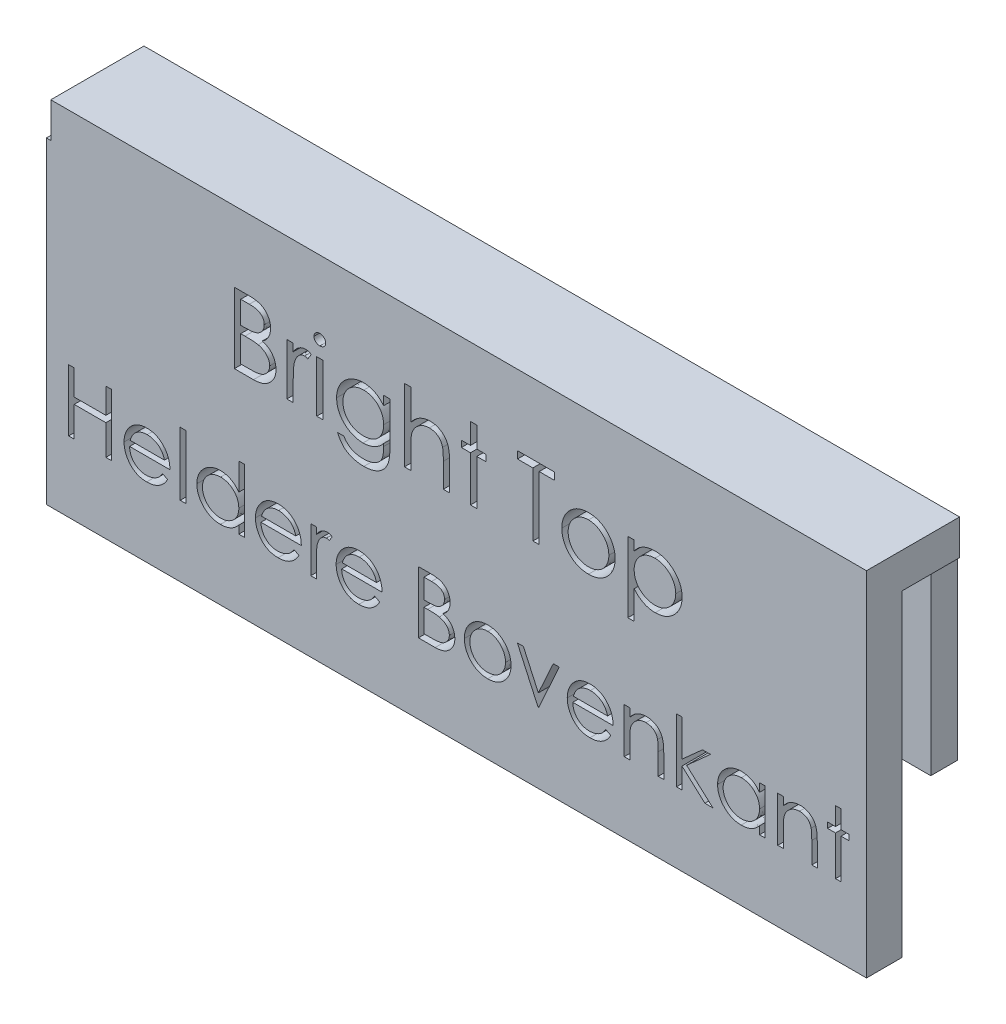
from build123d import *

# Parameters (mm, degrees)
SKETCH1_W           = 46.5
SKETCH1_H           = 18
BOSS_EXTRUDE1_DEPTH = 2
SKETCH3_W           = 46.138929178
SKETCH3_H           = 1.526595811
BOSS_EXTRUDE2_DEPTH = 10
SKETCH4_W           = 46.248898518
SKETCH4_H           = 5.280281263
BOSS_EXTRUDE3_DEPTH = 2
SKETCH5_W           = 0.358974359
SKETCH5_H           = 2.923076923
SKETCH5_W_2         = 0.314102564
SKETCH5_H_2         = 3.58974359
CUT_EXTRUDE1_DEPTH  = 3.753685452


with BuildPart() as part:
    # Sketch1 → Boss-Extrude1 (new body)
    with BuildSketch(Plane.XY):
        with Locations((32.25, 16)):
            Rectangle(SKETCH1_W, SKETCH1_H)
    extrude(amount=BOSS_EXTRUDE1_DEPTH)



with BuildPart() as body_2:
    # Sketch3 → Boss-Extrude2 (new body)
    with BuildSketch(Plane(origin=(0, 15, 0), x_dir=(1, 0, 0), z_dir=(0, 1, 0))):
        with Locations((32.320566071, 2.516983358)):
            Rectangle(SKETCH3_W, SKETCH3_H)
    extrude(amount=BOSS_EXTRUDE2_DEPTH)


with BuildPart() as part_1:
    add(part.part)

    add(body_2.part)  # Boss-Extrude3 merges body 2
    # Sketch4 → Boss-Extrude3 (add)
    with BuildSketch(Plane(origin=(0, 25, 0), x_dir=(1, 0, 0), z_dir=(0, 1, 0))):
        with Locations((32.375550741, 0.640140632)):
            Rectangle(SKETCH4_W, SKETCH4_H)
    extrude(amount=BOSS_EXTRUDE3_DEPTH)

    # Sketch5 → Cut-Extrude1 (cut)
    # profile 1 of 26: a face of its own
    with BuildSketch(Plane.XY.offset(2)):
        with BuildLine():
            Line((19.66025641, 23), (20.440705128, 23))
            add(Edge.make_bspline(
                [(20.440705128, 23), (20.51476772, 23.000620806), (20.622555874, 22.996562175), (20.761492877, 22.985125735), (20.85555456, 22.97207951), (20.942778163, 22.95631342), (21.023426908, 22.937226607), (21.097244233, 22.914338814), (21.185373127, 22.877943132), (21.285853517, 22.823859483), (21.394653149, 22.743941116), (21.487681075, 22.64618979), (21.567914998, 22.535923657), (21.631608882, 22.414626542), (21.693988741, 22.240711031), (21.712398757, 22.102075937), (21.711538462, 22.008814103)],
                knots=[0, 0, 0, 0, 0.121322939, 0.176680142, 0.228365096, 0.276868446, 0.321879128, 0.364098625, 0.403355696, 0.477967948, 0.550535461, 0.623584457, 0.698174882, 0.77335367, 0.847281125, 1, 1, 1, 1], degree=3))
            add(Edge.make_bspline(
                [(21.711538462, 22.008814103), (21.712169602, 21.922041728), (21.697484121, 21.793170332), (21.647552529, 21.630011258), (21.596525281, 21.51569109), (21.530093488, 21.410544927), (21.424060001, 21.279714522), (21.321003671, 21.203335048), (21.249198718, 21.157852564)],
                knots=[0, 0, 0, 0, 0.256580609, 0.380551617, 0.503622917, 0.625739323, 0.747548582, 1, 1, 1, 1], degree=3))
            add(Edge.make_bspline(
                [(21.249198718, 21.157852564), (21.336419643, 21.12568771), (21.459856129, 21.073878751), (21.604295743, 20.983817262), (21.691610972, 20.913741624), (21.766281402, 20.838184285), (21.831485571, 20.756065266), (21.887119293, 20.666306536), (21.934799103, 20.569844805), (21.971967648, 20.467668378), (22.00963391, 20.323655355), (22.018478779, 20.211048984), (22.019230769, 20.135416667)],
                knots=[0, 0, 0, 0, 0.202914257, 0.290300165, 0.370222566, 0.446383721, 0.5213969, 0.598291083, 0.676142469, 0.7555287, 0.834887172, 1, 1, 1, 1], degree=3))
            add(Edge.make_bspline(
                [(22.019230769, 20.135416667), (22.018697579, 20.058685229), (22.009493813, 19.944581241), (21.972247625, 19.798819494), (21.934484431, 19.69527259), (21.885147339, 19.596231932), (21.825117772, 19.501588336), (21.753538185, 19.412291935), (21.673466518, 19.327350606), (21.582881158, 19.2509762), (21.485148883, 19.182957463), (21.379038788, 19.127022068), (21.266293699, 19.080020926), (21.145648585, 19.044171632), (20.970928442, 19.009654709), (20.834808357, 18.998909027), (20.741987179, 19)],
                knots=[0, 0, 0, 0, 0.120334558, 0.178180255, 0.235235126, 0.292682961, 0.351186248, 0.41045661, 0.471719854, 0.533761203, 0.595739024, 0.657887515, 0.72129518, 0.786822515, 0.854686154, 1, 1, 1, 1], degree=3))
            Line((20.741987179, 19), (19.66025641, 19))
            Line((19.66025641, 19), (19.66025641, 23))
        make_face()
        with BuildLine():
            Line((20.019230769, 22.58974359), (20.019230769, 21.307692308))
            Line((20.019230769, 21.307692308), (20.260416667, 21.307692308))
            add(Edge.make_bspline(
                [(20.260416667, 21.307692308), (20.328495859, 21.308979541), (20.427281006, 21.308874443), (20.554017062, 21.318640469), (20.638349915, 21.325728355), (20.715312863, 21.337240669), (20.784734387, 21.350946304), (20.847704205, 21.365440972), (20.920320889, 21.390091834), (21.002689552, 21.42652347), (21.090500478, 21.483062647), (21.167905307, 21.550405007), (21.233295834, 21.628108057), (21.286712595, 21.713672747), (21.336838347, 21.836844526), (21.354108666, 21.935369319), (21.352564103, 22.001602564)],
                knots=[0, 0, 0, 0, 0.139700332, 0.202288511, 0.260599533, 0.313190329, 0.361738933, 0.405706476, 0.445539985, 0.518831956, 0.58977824, 0.658867479, 0.728430478, 0.797282704, 0.864815377, 1, 1, 1, 1], degree=3))
            add(Edge.make_bspline(
                [(21.352564103, 22.001602564), (21.352389366, 22.045063261), (21.347097462, 22.109406909), (21.324687341, 22.190546329), (21.303615407, 22.247292233), (21.274137704, 22.29930621), (21.239437917, 22.348384032), (21.197511049, 22.392855056), (21.149788507, 22.434420192), (21.094921485, 22.471271066), (21.032942854, 22.503546297), (20.96301416, 22.529535451), (20.88631341, 22.552298045), (20.801662173, 22.568279362), (20.674848857, 22.586741091), (20.575057788, 22.589177967), (20.506410256, 22.58974359)],
                knots=[0, 0, 0, 0, 0.111817869, 0.164402372, 0.215869805, 0.26684111, 0.317478963, 0.369902136, 0.423400449, 0.479718398, 0.539241497, 0.602430689, 0.671029546, 0.744484798, 0.823453971, 1, 1, 1, 1], degree=3))
            Line((20.506410256, 22.58974359), (20.019230769, 22.58974359))
        make_face(mode=Mode.SUBTRACT)
        with BuildLine():
            Line((20.019230769, 20.897435897), (20.019230769, 19.41025641))
            Line((20.019230769, 19.41025641), (20.530448718, 19.41025641))
            add(Edge.make_bspline(
                [(20.530448718, 19.41025641), (20.600959375, 19.411283721), (20.702868365, 19.411884579), (20.833780965, 19.420574309), (20.920281413, 19.430458153), (20.99983628, 19.441175709), (21.071490786, 19.45558876), (21.135825856, 19.472101821), (21.210425115, 19.4976266), (21.294428771, 19.537279701), (21.384956874, 19.597067405), (21.465438825, 19.668293987), (21.533807056, 19.750729525), (21.58975111, 19.840364569), (21.644184821, 19.966523414), (21.660350531, 20.068059738), (21.66025641, 20.135416667)],
                knots=[0, 0, 0, 0, 0.139738989, 0.201795135, 0.259821934, 0.312205989, 0.360773434, 0.404540343, 0.443698099, 0.516840794, 0.587874336, 0.657965418, 0.728969389, 0.79930772, 0.866635778, 1, 1, 1, 1], degree=3))
            add(Edge.make_bspline(
                [(21.66025641, 20.135416667), (21.661142061, 20.177366169), (21.654737561, 20.239522224), (21.636120215, 20.319785965), (21.618400089, 20.377703802), (21.592541244, 20.432804611), (21.562364598, 20.486179329), (21.526979315, 20.537896305), (21.471844486, 20.603288349), (21.391638651, 20.678569662), (21.235432224, 20.780024311), (21.100151941, 20.828151067), (21.005608974, 20.850160256)],
                knots=[0, 0, 0, 0, 0.119602355, 0.177503371, 0.235142664, 0.292132593, 0.350871209, 0.410097863, 0.470731522, 0.594828704, 0.722578824, 1, 1, 1, 1], degree=3))
            add(Edge.make_bspline(
                [(21.005608974, 20.850160256), (20.963564067, 20.859536346), (20.894908854, 20.869772471), (20.79658198, 20.879737643), (20.708103965, 20.885723591), (20.60957887, 20.891860342), (20.458075465, 20.895261889), (20.339501821, 20.897925374), (20.257211538, 20.897435897)],
                knots=[0, 0, 0, 0, 0.171952819, 0.277056507, 0.394730576, 0.526177321, 0.671344767, 1, 1, 1, 1], degree=3))
            Line((20.257211538, 20.897435897), (20.019230769, 20.897435897))
        make_face(mode=Mode.SUBTRACT)
    # profile 2 of 26: a face of its own
    with BuildSketch(Plane.XY.offset(2)):
        with BuildLine():
            Line((22.634615385, 21.923076923), (22.993589744, 21.923076923))
            Line((22.993589744, 21.923076923), (22.993589744, 21.492788462))
            add(Edge.make_bspline(
                [(22.993589744, 21.492788462), (23.042755604, 21.570175843), (23.120415264, 21.677338911), (23.241325999, 21.794700124), (23.3300527, 21.861589586), (23.421916735, 21.911601402), (23.54485764, 21.960375355), (23.642638892, 21.973914384), (23.706730769, 21.974358974)],
                knots=[0, 0, 0, 0, 0.306112383, 0.438366514, 0.560541455, 0.675317225, 0.786113634, 1, 1, 1, 1], degree=3))
            add(Edge.make_bspline(
                [(23.706730769, 21.974358974), (23.75813243, 21.973959636), (23.868380236, 21.954653349), (23.968555221, 21.904895736), (24.019230769, 21.874198718)],
                knots=[0, 0, 0, 0, 0.463523195, 1, 1, 1, 1], degree=3))
            Line((24.019230769, 21.874198718), (23.822115385, 21.563301282))
            add(Edge.make_bspline(
                [(23.822115385, 21.563301282), (23.78941477, 21.577781664), (23.730588875, 21.604359536), (23.666832126, 21.615016171), (23.638621795, 21.615384615)],
                knots=[0, 0, 0, 0, 0.560229945, 1, 1, 1, 1], degree=3))
            add(Edge.make_bspline(
                [(23.638621795, 21.615384615), (23.579736052, 21.615460642), (23.489588337, 21.593886147), (23.381081924, 21.528931504), (23.314596832, 21.473862979), (23.263120479, 21.420650942), (23.226388563, 21.374198841), (23.192694532, 21.322107963), (23.160497916, 21.265274734), (23.131173421, 21.202724511), (23.093628919, 21.110090402), (23.071318762, 21.036401396), (23.057692308, 20.985576923)],
                knots=[0, 0, 0, 0, 0.191338128, 0.295190617, 0.410312337, 0.471930251, 0.536425159, 0.603118728, 0.674117672, 0.749332023, 0.828283384, 1, 1, 1, 1], degree=3))
            add(Edge.make_bspline(
                [(23.057692308, 20.985576923), (23.044263943, 20.934539399), (23.031162281, 20.84862847), (23.01719227, 20.723212034), (23.009022937, 20.605570178), (23.001533621, 20.472295051), (22.995505874, 20.262860105), (22.992965221, 20.097778265), (22.993589744, 19.982371795)],
                knots=[0, 0, 0, 0, 0.15693815, 0.258600395, 0.37589093, 0.508166168, 0.656237809, 1, 1, 1, 1], degree=3))
            Line((22.993589744, 19.982371795), (22.993589744, 19))
            Line((22.993589744, 19), (22.634615385, 19))
            Line((22.634615385, 19), (22.634615385, 21.923076923))
        make_face()
    # profile 3 of 26: a face of its own
    with BuildSketch(Plane.XY.offset(2)):
        with Locations((24.506410257, 20.461538461)):
            Rectangle(SKETCH5_W, SKETCH5_H)
    # profile 4 of 26: a face of its own
    with BuildSketch(Plane.XY.offset(2)):
        with BuildLine():
            Line((28.121794872, 21.923076923), (28.480769231, 21.923076923))
            Line((28.480769231, 21.923076923), (28.480769231, 19.603365385))
            add(Edge.make_bspline(
                [(28.480769231, 19.603365385), (28.480254123, 19.508020787), (28.4790413, 19.369943976), (28.466155414, 19.193261963), (28.455645364, 19.075815787), (28.440464325, 18.968878392), (28.417139247, 18.845823908), (28.393860506, 18.759683995), (28.374198718, 18.706730769)],
                knots=[0, 0, 0, 0, 0.315488713, 0.456290824, 0.58586415, 0.705428686, 0.813370713, 1, 1, 1, 1], degree=3))
            add(Edge.make_bspline(
                [(28.374198718, 18.706730769), (28.350569158, 18.641472729), (28.307567901, 18.54753052), (28.236171138, 18.431183755), (28.175851623, 18.350672461), (28.108253809, 18.27641846), (28.035020056, 18.206790212), (27.954710653, 18.143265683), (27.867375151, 18.08693953), (27.775025808, 18.036211624), (27.677715998, 17.992272156), (27.575994318, 17.95400351), (27.468905427, 17.925329645), (27.358127525, 17.900520188), (27.201314904, 17.878463421), (27.080876775, 17.871200902), (26.999198718, 17.871794872)],
                knots=[0, 0, 0, 0, 0.120906468, 0.179423665, 0.237606687, 0.295938468, 0.354218227, 0.413537067, 0.474086783, 0.535121189, 0.596987665, 0.660019834, 0.724277496, 0.79001185, 0.857747684, 1, 1, 1, 1], degree=3))
            add(Edge.make_bspline(
                [(26.999198718, 17.871794872), (26.881058096, 17.870244525), (26.707954236, 17.885235676), (26.485117059, 17.928501687), (26.332458946, 17.976102496), (26.191579373, 18.034446163), (26.063437187, 18.101407785), (25.949186309, 18.178197168), (25.846181343, 18.265623834), (25.753245111, 18.369591672), (25.630327042, 18.541504315), (25.554002054, 18.689333527), (25.506410256, 18.794871795)],
                knots=[0, 0, 0, 0, 0.188473675, 0.276839915, 0.362136562, 0.443436755, 0.520165521, 0.592709664, 0.662917334, 0.7354188, 0.81488097, 1, 1, 1, 1], degree=3))
            Line((25.506410256, 18.794871795), (25.865384615, 18.794871795))
            add(Edge.make_bspline(
                [(25.865384615, 18.794871795), (25.918055498, 18.703073075), (26.014751542, 18.578522446), (26.171957597, 18.444307975), (26.30157682, 18.364356932), (26.445850384, 18.304170182), (26.666094509, 18.244419014), (26.843259367, 18.231341325), (26.96474359, 18.230769231)],
                knots=[0, 0, 0, 0, 0.243805374, 0.360061534, 0.475112, 0.593525098, 0.71935017, 1, 1, 1, 1], degree=3))
            add(Edge.make_bspline(
                [(26.96474359, 18.230769231), (27.085178701, 18.231399676), (27.260965934, 18.244589985), (27.479921623, 18.304177275), (27.622272296, 18.364259684), (27.746908399, 18.437927423), (27.854350451, 18.520210791), (27.941372985, 18.612989672), (27.999902102, 18.698454457), (28.036284471, 18.774596339), (28.059452927, 18.840142157), (28.078279509, 18.914259741), (28.094031396, 18.996700545), (28.107011835, 19.087582597), (28.118525019, 19.225725327), (28.122366705, 19.333794353), (28.121794872, 19.408653846)],
                knots=[0, 0, 0, 0, 0.189264436, 0.274463056, 0.355023171, 0.430920462, 0.501086045, 0.566607627, 0.629720863, 0.662710695, 0.698765562, 0.738610537, 0.782581228, 0.830408787, 0.882577866, 1, 1, 1, 1], degree=3))
            Line((28.121794872, 19.408653846), (28.121794872, 19.560096154))
            add(Edge.make_bspline(
                [(28.121794872, 19.560096154), (28.052167199, 19.472202799), (27.934812469, 19.350852962), (27.752098493, 19.221154459), (27.604629012, 19.141528205), (27.449427104, 19.077984231), (27.233522512, 19.017954123), (27.065849671, 18.999210343), (26.953525641, 19)],
                knots=[0, 0, 0, 0, 0.250895262, 0.374719265, 0.499826424, 0.624963531, 0.749039475, 1, 1, 1, 1], degree=3))
            add(Edge.make_bspline(
                [(26.953525641, 19), (26.887063744, 18.999697783), (26.788025361, 19.006821807), (26.657756994, 19.026876978), (26.562204686, 19.048654127), (26.468198444, 19.076652771), (26.375892578, 19.111641141), (26.284539989, 19.151201872), (26.195801131, 19.1977992), (26.110559839, 19.24964188), (26.029459056, 19.305800601), (25.952923583, 19.365981505), (25.881681881, 19.430778007), (25.815827399, 19.50009633), (25.754474406, 19.573197533), (25.698637444, 19.65110238), (25.647170691, 19.732390333), (25.602533572, 19.817602813), (25.563351133, 19.904892081), (25.529284353, 19.994071398), (25.502119741, 20.085439692), (25.481391178, 20.178938023), (25.460578019, 20.307152061), (25.455717185, 20.405342468), (25.455128205, 20.471153846)],
                knots=[0, 0, 0, 0, 0.085222258, 0.127202284, 0.169025313, 0.210882033, 0.252962678, 0.295628285, 0.338553294, 0.381463248, 0.423581562, 0.465066165, 0.506312219, 0.547039505, 0.587675833, 0.628674786, 0.669946465, 0.711035574, 0.751995829, 0.792672607, 0.833446018, 0.874190607, 0.915493583, 1, 1, 1, 1], degree=3))
            add(Edge.make_bspline(
                [(25.455128205, 20.471153846), (25.454816792, 20.537362685), (25.462064042, 20.635824131), (25.481751967, 20.765445443), (25.504815947, 20.859967658), (25.532621315, 20.953252845), (25.567046046, 21.044613432), (25.608439511, 21.134076853), (25.655307633, 21.221709465), (25.707975212, 21.30633531), (25.765726607, 21.38670862), (25.828631609, 21.462237959), (25.895822369, 21.533685298), (25.968119303, 21.60036129), (26.045485008, 21.662104109), (26.127156871, 21.719948701), (26.213388015, 21.772647408), (26.302847885, 21.819255557), (26.393263685, 21.861784725), (26.485833065, 21.895536226), (26.57883037, 21.925283456), (26.673892695, 21.946327914), (26.802011862, 21.968149884), (26.899675319, 21.974284448), (26.96474359, 21.974358974)],
                knots=[0, 0, 0, 0, 0.083905433, 0.125068934, 0.16615847, 0.207210273, 0.248490732, 0.289878112, 0.332169514, 0.374475842, 0.41622498, 0.457609587, 0.49907317, 0.540553362, 0.582248849, 0.62454975, 0.667432801, 0.710322543, 0.752467119, 0.794064757, 0.835215707, 0.876228344, 0.917446189, 1, 1, 1, 1], degree=3))
            add(Edge.make_bspline(
                [(26.96474359, 21.974358974), (27.070892825, 21.974184814), (27.228787739, 21.959223368), (27.43175448, 21.90737437), (27.577929917, 21.852561768), (27.720640639, 21.777614547), (27.913248539, 21.640930919), (28.039968511, 21.507464912), (28.121794872, 21.411858974)],
                knots=[0, 0, 0, 0, 0.238762229, 0.354754859, 0.470359399, 0.589144099, 0.716328905, 1, 1, 1, 1], degree=3))
            Line((28.121794872, 21.411858974), (28.121794872, 21.923076923))
        make_face()
        with BuildLine():
            add(Edge.make_bspline(
                [(26.993589744, 21.615384615), (26.889648065, 21.615757209), (26.734900517, 21.596335839), (26.537785458, 21.532597907), (26.398807322, 21.465087653), (26.268628328, 21.382672573), (26.153112545, 21.282860791), (26.05208462, 21.16886356), (25.966594654, 21.041721077), (25.898647225, 20.90455174), (25.833775263, 20.711119212), (25.813339531, 20.558914188), (25.814102564, 20.456730769)],
                knots=[0, 0, 0, 0, 0.169309287, 0.252217903, 0.336756454, 0.420595494, 0.502741104, 0.584803551, 0.668268485, 0.75182313, 0.833628628, 1, 1, 1, 1], degree=3))
            add(Edge.make_bspline(
                [(25.814102564, 20.456730769), (25.813807568, 20.380502737), (25.823102753, 20.267524532), (25.857625915, 20.123143496), (25.893517627, 20.021854733), (25.938044666, 19.925300468), (25.994033347, 19.834147112), (26.059920883, 19.748313156), (26.135187362, 19.66843349), (26.21813184, 19.595678224), (26.308096667, 19.53174856), (26.404959658, 19.479463794), (26.506339455, 19.434267579), (26.614692345, 19.40128872), (26.769225176, 19.36694273), (26.890280759, 19.359368936), (26.971955128, 19.358974359)],
                knots=[0, 0, 0, 0, 0.127802645, 0.189056336, 0.248394647, 0.307690706, 0.366976619, 0.427340044, 0.488794715, 0.550673693, 0.612045111, 0.673369139, 0.734929754, 0.797809968, 0.862891673, 1, 1, 1, 1], degree=3))
            add(Edge.make_bspline(
                [(26.971955128, 19.358974359), (27.054519773, 19.358969521), (27.176058313, 19.367554171), (27.331783957, 19.400135447), (27.439672103, 19.433890413), (27.541534411, 19.477009083), (27.636225349, 19.531563086), (27.725775574, 19.593694435), (27.807325814, 19.666165154), (27.88106749, 19.746033766), (27.945332063, 19.832942188), (28.00008832, 19.925582852), (28.045445966, 20.023944886), (28.080019313, 20.128794283), (28.111859333, 20.279935753), (28.12273797, 20.397500335), (28.121794872, 20.477564103)],
                knots=[0, 0, 0, 0, 0.137121849, 0.201487121, 0.263765119, 0.324560095, 0.384738887, 0.444904604, 0.50523192, 0.565493995, 0.625099744, 0.684349714, 0.743882825, 0.804608206, 0.867238914, 1, 1, 1, 1], degree=3))
            add(Edge.make_bspline(
                [(28.121794872, 20.477564103), (28.12227578, 20.581533499), (28.105566543, 20.735738739), (28.043486376, 20.929186645), (27.979727923, 21.062254183), (27.899730947, 21.184391126), (27.803403101, 21.293333515), (27.692378183, 21.38921644), (27.566980407, 21.469114783), (27.432074341, 21.533591534), (27.243156842, 21.598643986), (27.093112166, 21.614075497), (26.993589744, 21.615384615)],
                knots=[0, 0, 0, 0, 0.174349058, 0.257613109, 0.339527367, 0.42099739, 0.501579059, 0.58254176, 0.666132658, 0.750049131, 0.83274294, 1, 1, 1, 1], degree=3))
        make_face(mode=Mode.SUBTRACT)
    # profile 5 of 26: a face of its own
    with BuildSketch(Plane.XY.offset(2)):
        with BuildLine():
            Line((29.301282051, 23.102564103), (29.66025641, 23.102564103))
            Line((29.66025641, 23.102564103), (29.66025641, 21.37099359))
            add(Edge.make_bspline(
                [(29.66025641, 21.37099359), (29.732444413, 21.466989544), (29.85207379, 21.596390421), (30.029820337, 21.741312694), (30.167330409, 21.825795014), (30.310256672, 21.892406605), (30.510003033, 21.956227791), (30.667339347, 21.974141927), (30.772435897, 21.974358974)],
                knots=[0, 0, 0, 0, 0.273995891, 0.40068416, 0.522554679, 0.641533771, 0.759969143, 1, 1, 1, 1], degree=3))
            add(Edge.make_bspline(
                [(30.772435897, 21.974358974), (30.878003928, 21.973655778), (31.035588626, 21.95652174), (31.230508815, 21.884786886), (31.363835312, 21.812658319), (31.483636523, 21.722730051), (31.589750134, 21.618926905), (31.676425433, 21.498612699), (31.735395855, 21.38746298), (31.773765402, 21.288561506), (31.798053438, 21.203719787), (31.818645799, 21.109180456), (31.836592682, 21.004992185), (31.848532705, 20.890654874), (31.861937544, 20.719015601), (31.866274842, 20.585267006), (31.865384615, 20.492788462)],
                knots=[0, 0, 0, 0, 0.151154907, 0.223453638, 0.295497225, 0.366919857, 0.436794085, 0.506696431, 0.577863847, 0.61591181, 0.658048026, 0.703775986, 0.754080143, 0.808979421, 0.867913193, 1, 1, 1, 1], degree=3))
            Line((31.865384615, 20.492788462), (31.865384615, 19))
            Line((31.865384615, 19), (31.506410256, 19))
            Line((31.506410256, 19), (31.506410256, 20.375))
            add(Edge.make_bspline(
                [(31.506410256, 20.375), (31.505894966, 20.45112163), (31.50563093, 20.56012957), (31.501330879, 20.698765095), (31.496376121, 20.787165437), (31.491135498, 20.865228652), (31.482371255, 20.948604599), (31.47285971, 21.005717917), (31.46474359, 21.040064103)],
                knots=[0, 0, 0, 0, 0.342141307, 0.489870991, 0.623312103, 0.740055623, 0.841468004, 1, 1, 1, 1], degree=3))
            add(Edge.make_bspline(
                [(31.46474359, 21.040064103), (31.442578366, 21.127675286), (31.396202547, 21.252715295), (31.295339153, 21.392116727), (31.206420135, 21.474325349), (31.102915504, 21.538740679), (30.938395831, 21.60091347), (30.802424596, 21.615805103), (30.709134615, 21.615384615)],
                knots=[0, 0, 0, 0, 0.26195405, 0.379637675, 0.494379033, 0.609866212, 0.729887486, 1, 1, 1, 1], degree=3))
            add(Edge.make_bspline(
                [(30.709134615, 21.615384615), (30.652018637, 21.61566098), (30.56661312, 21.609143583), (30.456162942, 21.585283017), (30.375703951, 21.561419417), (30.29869441, 21.528902873), (30.222890654, 21.491270352), (30.150440127, 21.445203225), (30.080056301, 21.393516795), (30.014550692, 21.336294134), (29.953604897, 21.275897759), (29.899277266, 21.211583021), (29.85004904, 21.144384688), (29.807585309, 21.073370291), (29.757846423, 20.974247904), (29.729932644, 20.895353984), (29.715544872, 20.841346154)],
                knots=[0, 0, 0, 0, 0.126693877, 0.189084395, 0.250362632, 0.312516479, 0.374242602, 0.437850162, 0.502657326, 0.567745439, 0.630575914, 0.69277209, 0.754267546, 0.815120554, 0.876051359, 1, 1, 1, 1], degree=3))
            add(Edge.make_bspline(
                [(29.715544872, 20.841346154), (29.704854241, 20.799148058), (29.692813689, 20.729436371), (29.681081566, 20.628343861), (29.67299471, 20.535904349), (29.668061448, 20.431912456), (29.660621986, 20.271193946), (29.660768511, 20.144751363), (29.66025641, 20.056891026)],
                knots=[0, 0, 0, 0, 0.165611346, 0.269045027, 0.387447975, 0.518826658, 0.665393555, 1, 1, 1, 1], degree=3))
            Line((29.66025641, 20.056891026), (29.66025641, 19))
            Line((29.66025641, 19), (29.301282051, 19))
            Line((29.301282051, 19), (29.301282051, 23.102564103))
        make_face()
    # profile 6 of 26: a face of its own
    with BuildSketch(Plane.XY.offset(2)):
        Polygon((33.044871795, 23.102564103), (33.403846154, 23.102564103), (33.403846154, 21.923076923), (33.916666667, 21.923076923), (33.916666667, 21.564102564), (33.403846154, 21.564102564), (33.403846154, 19), (33.044871795, 19), (33.044871795, 21.564102564), (32.532051282, 21.564102564), (32.532051282, 21.923076923), (33.044871795, 21.923076923), align=None)
    # profile 7 of 26: a face of its own
    with BuildSketch(Plane.XY.offset(2)):
        Polygon((35.711538462, 22.58974359), (35.711538462, 23), (37.814102564, 23), (37.814102564, 22.58974359), (36.942307692, 22.58974359), (36.942307692, 19), (36.583333333, 19), (36.583333333, 22.58974359), align=None)
    # profile 8 of 26: a face of its own
    with BuildSketch(Plane.XY.offset(2)):
        with BuildLine():
            Line((41.967948718, 21.923076923), (42.326923077, 21.923076923))
            Line((42.326923077, 21.923076923), (42.326923077, 21.382211538))
            add(Edge.make_bspline(
                [(42.326923077, 21.382211538), (42.39796906, 21.47970805), (42.517314994, 21.612203569), (42.701632798, 21.754113558), (42.846907964, 21.835747346), (43.000545915, 21.89719164), (43.219100384, 21.959076442), (43.391760634, 21.973991606), (43.508012821, 21.974358974)],
                knots=[0, 0, 0, 0, 0.263044683, 0.386061082, 0.505770653, 0.625178031, 0.746147722, 1, 1, 1, 1], degree=3))
            add(Edge.make_bspline(
                [(43.508012821, 21.974358974), (43.610450227, 21.973332549), (43.762774363, 21.96194999), (43.958699041, 21.915357967), (44.097632022, 21.865795105), (44.23164747, 21.804464378), (44.358758306, 21.727076241), (44.480945248, 21.637468404), (44.595135235, 21.534346154), (44.700645121, 21.422770946), (44.791898801, 21.302745432), (44.870606301, 21.178216894), (44.934241404, 21.047254006), (44.984034992, 20.910891034), (45.032005545, 20.719181915), (45.044285424, 20.569917703), (45.044871795, 20.469551282)],
                knots=[0, 0, 0, 0, 0.128636051, 0.190652902, 0.252125037, 0.313446276, 0.375227279, 0.438498083, 0.5032851, 0.568009687, 0.630878982, 0.692153504, 0.75255215, 0.813191094, 0.8739854, 1, 1, 1, 1], degree=3))
            add(Edge.make_bspline(
                [(45.044871795, 20.469551282), (45.044639521, 20.367254996), (45.031472878, 20.215612477), (44.985010742, 20.020503102), (44.935850966, 19.881901201), (44.872247403, 19.749348274), (44.794874358, 19.622941009), (44.703574552, 19.502719639), (44.599230679, 19.390316257), (44.486027256, 19.286774449), (44.365024406, 19.1962157), (44.238100002, 19.120171888), (44.10590292, 19.05663575), (43.967303391, 19.008806742), (43.772689532, 18.962005845), (43.621228039, 18.949086768), (43.519230769, 18.948717949)],
                knots=[0, 0, 0, 0, 0.128034164, 0.189573725, 0.250579835, 0.311733221, 0.37325008, 0.435762516, 0.500345561, 0.564949367, 0.627527909, 0.68915729, 0.749865012, 0.8107602, 0.872299761, 1, 1, 1, 1], degree=3))
            add(Edge.make_bspline(
                [(43.519230769, 18.948717949), (43.404407674, 18.947392334), (43.234689052, 18.967007412), (43.017175475, 19.027082055), (42.863802308, 19.091788305), (42.717365358, 19.174419151), (42.528721862, 19.310990701), (42.404113168, 19.438059692), (42.326923077, 19.529647436)],
                knots=[0, 0, 0, 0, 0.250547782, 0.371230204, 0.49211577, 0.613400988, 0.73799732, 1, 1, 1, 1], degree=3))
            Line((42.326923077, 19.529647436), (42.326923077, 17.923076923))
            Line((42.326923077, 17.923076923), (41.967948718, 17.923076923))
            Line((41.967948718, 17.923076923), (41.967948718, 21.923076923))
        make_face()
        with BuildLine():
            add(Edge.make_bspline(
                [(43.504807692, 21.615384615), (43.42468695, 21.616565126), (43.306484952, 21.605055965), (43.153729637, 21.571215946), (43.046160394, 21.5336531), (42.943017177, 21.487469604), (42.845092321, 21.429779476), (42.752455141, 21.361604765), (42.665338474, 21.284257214), (42.58663777, 21.19902893), (42.516965123, 21.10807144), (42.458445159, 21.011499892), (42.409861531, 20.910213598), (42.372934978, 20.803419616), (42.337262745, 20.652366747), (42.327148269, 20.534588032), (42.326923077, 20.455128205)],
                knots=[0, 0, 0, 0, 0.130023749, 0.192374057, 0.253884304, 0.314896085, 0.375805828, 0.438242236, 0.501591268, 0.56488076, 0.626533341, 0.687515765, 0.748105916, 0.808795537, 0.870821519, 1, 1, 1, 1], degree=3))
            add(Edge.make_bspline(
                [(42.326923077, 20.455128205), (42.327114164, 20.351383209), (42.344406781, 20.196991651), (42.408438519, 20.002895416), (42.475262075, 19.868656416), (42.559791267, 19.745247214), (42.66161299, 19.634742471), (42.77983429, 19.537844093), (42.912482388, 19.456199646), (43.054678295, 19.390003548), (43.252566226, 19.326337024), (43.407409399, 19.307886096), (43.510416667, 19.307692308)],
                knots=[0, 0, 0, 0, 0.169344011, 0.251060671, 0.332326431, 0.413189279, 0.494299499, 0.57665388, 0.661784919, 0.74776493, 0.831967435, 1, 1, 1, 1], degree=3))
            add(Edge.make_bspline(
                [(43.510416667, 19.307692308), (43.611537596, 19.307079402), (43.762592717, 19.327532186), (43.955649316, 19.390309108), (44.093000265, 19.458288591), (44.221940474, 19.541729675), (44.338378006, 19.641792025), (44.440095177, 19.75778192), (44.526816324, 19.886935243), (44.59661036, 20.025417007), (44.666613753, 20.215615407), (44.684749202, 20.366320253), (44.685897436, 20.465544872)],
                knots=[0, 0, 0, 0, 0.165573796, 0.248158777, 0.332033307, 0.416257349, 0.49952535, 0.58303856, 0.668595904, 0.75403535, 0.8369197, 1, 1, 1, 1], degree=3))
            add(Edge.make_bspline(
                [(44.685897436, 20.465544872), (44.687304904, 20.565568087), (44.664902864, 20.715191749), (44.599187201, 20.906540895), (44.527795185, 21.043139732), (44.442965693, 21.172023018), (44.340404982, 21.285800415), (44.225413303, 21.385419272), (44.096625424, 21.467740328), (43.958410614, 21.53314308), (43.762951173, 21.597770644), (43.608237891, 21.614933216), (43.504807692, 21.615384615)],
                knots=[0, 0, 0, 0, 0.163349297, 0.245826474, 0.33036716, 0.415198374, 0.497940932, 0.580476126, 0.663740011, 0.747512837, 0.830398741, 1, 1, 1, 1], degree=3))
        make_face(mode=Mode.SUBTRACT)
    # profile 9 of 26: a face of its own
    with BuildSketch(Plane.XY.offset(2)):
        Polygon((10.262820513, 14.5), (10.576923077, 14.5), (10.576923077, 13.064102564), (12.371794872, 13.064102564), (12.371794872, 14.5), (12.685897436, 14.5), (12.685897436, 11), (12.371794872, 11), (12.371794872, 12.705128205), (10.576923077, 12.705128205), (10.576923077, 11), (10.262820513, 11), align=None)
    # profile 10 of 26: a face of its own
    with BuildSketch(Plane.XY.offset(2)):
        with BuildLine():
            Line((15.592748397, 11.807692308), (15.871794872, 11.661157853))
            add(Edge.make_bspline(
                [(15.871794872, 11.661157853), (15.830294036, 11.583465218), (15.760823045, 11.474469332), (15.653877161, 11.344707178), (15.568804168, 11.262960759), (15.479126562, 11.19171381), (15.384395975, 11.129374293), (15.28410666, 11.076258211), (15.178256843, 11.031497519), (15.065958194, 10.997119284), (14.903574921, 10.963793586), (14.776698439, 10.955139365), (14.690404647, 10.955128205)],
                knots=[0, 0, 0, 0, 0.181660766, 0.265874227, 0.346354784, 0.424599862, 0.501903184, 0.579992091, 0.658443431, 0.738672236, 0.821894148, 1, 1, 1, 1], degree=3))
            add(Edge.make_bspline(
                [(14.690404647, 10.955128205), (14.594633967, 10.955167088), (14.453712272, 10.966163371), (14.274480429, 11.009309726), (14.151270377, 11.0532354), (14.036527698, 11.110673027), (13.930026954, 11.180629776), (13.831207409, 11.262762771), (13.743183163, 11.357779015), (13.663939444, 11.459461018), (13.594013025, 11.565416919), (13.535557766, 11.675380035), (13.487997187, 11.788650969), (13.44962179, 11.904513344), (13.413540505, 12.064960489), (13.404760881, 12.188812296), (13.403846154, 12.271834936)],
                knots=[0, 0, 0, 0, 0.139629225, 0.204796697, 0.268134963, 0.329813747, 0.391301398, 0.453433515, 0.51655169, 0.579631271, 0.641118921, 0.701294047, 0.760810336, 0.819931722, 0.878919575, 1, 1, 1, 1], degree=3))
            add(Edge.make_bspline(
                [(13.403846154, 12.271834936), (13.404799442, 12.349628638), (13.412075522, 12.465757498), (13.443702902, 12.616301209), (13.475850334, 12.725188901), (13.517429436, 12.830729151), (13.585602212, 12.968240187), (13.650766045, 13.064309458), (13.698317308, 13.125801282)],
                knots=[0, 0, 0, 0, 0.2537679, 0.377428427, 0.500550841, 0.623295883, 0.746578332, 1, 1, 1, 1], degree=3))
            add(Edge.make_bspline(
                [(13.698317308, 13.125801282), (13.758890368, 13.201525831), (13.857658343, 13.307407667), (14.012320495, 13.418170194), (14.133897518, 13.486209739), (14.264238953, 13.537842269), (14.450784979, 13.590336672), (14.598660776, 13.601365522), (14.698116987, 13.602564103)],
                knots=[0, 0, 0, 0, 0.253589335, 0.374643257, 0.495340042, 0.616324775, 0.739759335, 1, 1, 1, 1], degree=3))
            add(Edge.make_bspline(
                [(14.698116987, 13.602564103), (14.800944489, 13.602996076), (14.95285275, 13.588115871), (15.145445813, 13.53482662), (15.279290159, 13.479740989), (15.40495967, 13.408529242), (15.563234846, 13.289458457), (15.66667776, 13.179818766), (15.728064904, 13.099158654)],
                knots=[0, 0, 0, 0, 0.259032841, 0.381879824, 0.502258444, 0.62275219, 0.744742632, 1, 1, 1, 1], degree=3))
            add(Edge.make_bspline(
                [(15.728064904, 13.099158654), (15.773951556, 13.04026983), (15.833860596, 12.944630667), (15.897471364, 12.807844645), (15.935848142, 12.698962911), (15.966858275, 12.585136561), (15.997459758, 12.422780442), (16.004820792, 12.296798103), (16.006410256, 12.211538462)],
                knots=[0, 0, 0, 0, 0.236254763, 0.356174434, 0.477249655, 0.601539871, 0.729618382, 1, 1, 1, 1], degree=3))
            Line((16.006410256, 12.211538462), (13.717948718, 12.211538462))
            add(Edge.make_bspline(
                [(13.717948718, 12.211538462), (13.719737442, 12.145292451), (13.728617789, 12.047436192), (13.75889832, 11.922222901), (13.790144084, 11.835140321), (13.828016999, 11.752210074), (13.874401095, 11.674048066), (13.929741089, 11.601010141), (13.991466667, 11.532442954), (14.060173797, 11.471382382), (14.132456527, 11.416729918), (14.209350129, 11.370926843), (14.290248082, 11.333737581), (14.375020357, 11.30466651), (14.495002422, 11.27760005), (14.588130673, 11.268881085), (14.651141827, 11.269230769)],
                knots=[0, 0, 0, 0, 0.134475588, 0.198391058, 0.260753477, 0.321829223, 0.383037238, 0.444653123, 0.507398011, 0.569825238, 0.630777641, 0.690928687, 0.750945133, 0.811049477, 0.872330853, 1, 1, 1, 1], degree=3))
            add(Edge.make_bspline(
                [(14.651141827, 11.269230769), (14.713335731, 11.268929938), (14.806631963, 11.276253), (14.928480257, 11.301772582), (15.017741, 11.327630859), (15.103311812, 11.359216089), (15.18255771, 11.397316602), (15.255436654, 11.439467744), (15.323558273, 11.487674102), (15.389610113, 11.546695427), (15.483107902, 11.651514358), (15.550223671, 11.741144824), (15.592748397, 11.807692308)],
                knots=[0, 0, 0, 0, 0.163878894, 0.24565874, 0.327725695, 0.408609961, 0.485749086, 0.559169056, 0.630268476, 0.705306028, 0.792064966, 1, 1, 1, 1], degree=3))
        make_face()
        with BuildLine():
            Line((13.750901442, 12.525641026), (15.692307692, 12.525641026))
            add(Edge.make_bspline(
                [(15.692307692, 12.525641026), (15.672433893, 12.60638204), (15.632818517, 12.720303304), (15.56034713, 12.857213239), (15.498761417, 12.942801791), (15.428933405, 13.018802755), (15.34829081, 13.085223014), (15.257854049, 13.144636168), (15.158095706, 13.19480502), (15.052451592, 13.237432508), (14.904644112, 13.275998431), (14.790685193, 13.289602535), (14.714242788, 13.288461538)],
                knots=[0, 0, 0, 0, 0.185231261, 0.267500523, 0.344400382, 0.419594869, 0.496890627, 0.576637919, 0.660267852, 0.745386615, 0.830040327, 1, 1, 1, 1], degree=3))
            add(Edge.make_bspline(
                [(14.714242788, 13.288461538), (14.652317431, 13.288613676), (14.560283538, 13.281916972), (14.441941371, 13.256189326), (14.357233544, 13.230253659), (14.27662524, 13.19562709), (14.171605214, 13.141211507), (14.100705171, 13.086968898), (14.055188301, 13.048677885)],
                knots=[0, 0, 0, 0, 0.259141276, 0.384161763, 0.505991952, 0.629098089, 0.750669123, 1, 1, 1, 1], degree=3))
            add(Edge.make_bspline(
                [(14.055188301, 13.048677885), (14.020307622, 13.01929537), (13.973101248, 12.968413201), (13.916371752, 12.893633931), (13.877009047, 12.830617227), (13.840950765, 12.761985632), (13.794732535, 12.661365787), (13.767335648, 12.580972868), (13.750901442, 12.525641026)],
                knots=[0, 0, 0, 0, 0.222580497, 0.338499871, 0.458708565, 0.585535346, 0.717517743, 1, 1, 1, 1], degree=3))
        make_face(mode=Mode.SUBTRACT)
    # profile 11 of 26: a face of its own
    with BuildSketch(Plane.XY.offset(2)):
        with Locations((16.746794872, 12.794871795)):
            Rectangle(SKETCH5_W_2, SKETCH5_H_2)
    # profile 12 of 26: a face of its own
    with BuildSketch(Plane.XY.offset(2)):
        with BuildLine():
            Line((20.224358974, 14.58974359), (20.224358974, 11))
            Line((20.224358974, 11), (19.91025641, 11))
            Line((19.91025641, 11), (19.91025641, 11.442407853))
            add(Edge.make_bspline(
                [(19.91025641, 11.442407853), (19.843018855, 11.362956656), (19.734507904, 11.252427181), (19.567880314, 11.137793014), (19.439214035, 11.069601901), (19.304286828, 11.018478013), (19.114233972, 10.969058407), (18.965821115, 10.954320855), (18.865584936, 10.955128205)],
                knots=[0, 0, 0, 0, 0.262084975, 0.386269912, 0.507164597, 0.627300236, 0.748144942, 1, 1, 1, 1], degree=3))
            add(Edge.make_bspline(
                [(18.865584936, 10.955128205), (18.776555524, 10.955346305), (18.644288413, 10.966840713), (18.47422177, 11.007700185), (18.352948059, 11.04955776), (18.237275684, 11.105150147), (18.126215646, 11.171688245), (18.020342953, 11.250929941), (17.921271355, 11.34151773), (17.830039593, 11.439912778), (17.749977459, 11.544858321), (17.683227511, 11.655900583), (17.627395829, 11.77163391), (17.584442784, 11.892948179), (17.543766208, 12.06365536), (17.532259274, 12.196351016), (17.532051282, 12.285857372)],
                knots=[0, 0, 0, 0, 0.127433484, 0.189004127, 0.249930071, 0.310668454, 0.372328961, 0.43493911, 0.499575544, 0.564191208, 0.626735217, 0.688109334, 0.749293607, 0.810330528, 0.87190117, 1, 1, 1, 1], degree=3))
            add(Edge.make_bspline(
                [(17.532051282, 12.285857372), (17.532568936, 12.373675136), (17.54330041, 12.504289686), (17.585296241, 12.672021703), (17.628805209, 12.791376968), (17.684657555, 12.905717466), (17.752582814, 13.015121372), (17.832602725, 13.11989079), (17.924854915, 13.217562059), (18.024789736, 13.307782484), (18.131698482, 13.386192224), (18.242921657, 13.453906554), (18.360185073, 13.507569328), (18.481750654, 13.550943593), (18.652963288, 13.591623077), (18.785987409, 13.601766481), (18.875400641, 13.602564103)],
                knots=[0, 0, 0, 0, 0.12607881, 0.186904093, 0.247573935, 0.308003356, 0.369131898, 0.432033228, 0.496790794, 0.561610823, 0.624913866, 0.686726349, 0.748078833, 0.809582291, 0.871630743, 1, 1, 1, 1], degree=3))
            add(Edge.make_bspline(
                [(18.875400641, 13.602564103), (18.977718612, 13.602316191), (19.129961707, 13.587686307), (19.321800267, 13.529007441), (19.456298387, 13.469975666), (19.582663432, 13.393142804), (19.744913777, 13.267150538), (19.846922475, 13.147237404), (19.91025641, 13.062700321)],
                knots=[0, 0, 0, 0, 0.252984972, 0.374210437, 0.494101513, 0.614752763, 0.73851107, 1, 1, 1, 1], degree=3))
            Line((19.91025641, 13.062700321), (19.91025641, 14.58974359))
            Line((19.91025641, 14.58974359), (20.224358974, 14.58974359))
        make_face()
        with BuildLine():
            add(Edge.make_bspline(
                [(18.879607372, 13.288461538), (18.789106361, 13.288066301), (18.653731024, 13.273049824), (18.482705993, 13.216499445), (18.361762395, 13.159275626), (18.249093939, 13.08723138), (18.148398774, 13.000114154), (18.058862348, 12.900275853), (17.983529901, 12.788174735), (17.922228805, 12.667994021), (17.864368317, 12.500877014), (17.845000276, 12.369829919), (17.846153846, 12.282351763)],
                knots=[0, 0, 0, 0, 0.169593435, 0.252475515, 0.336244477, 0.419504521, 0.502035907, 0.584774648, 0.669846475, 0.754184866, 0.836658238, 1, 1, 1, 1], degree=3))
            add(Edge.make_bspline(
                [(17.846153846, 12.282351763), (17.846901839, 12.195443041), (17.863533246, 12.063917538), (17.923424167, 11.89711593), (17.984599539, 11.775857087), (18.061304203, 11.663272773), (18.150188125, 11.561531369), (18.252139732, 11.474047092), (18.365066614, 11.400789331), (18.485675742, 11.341701907), (18.655144233, 11.286329667), (18.787900469, 11.268811102), (18.876802885, 11.269230769)],
                knots=[0, 0, 0, 0, 0.162858895, 0.245483689, 0.330807139, 0.416493374, 0.499893203, 0.583048156, 0.667157852, 0.751311929, 0.833784789, 1, 1, 1, 1], degree=3))
            add(Edge.make_bspline(
                [(18.876802885, 11.269230769), (18.967115259, 11.26961823), (19.102739835, 11.285241704), (19.275572915, 11.341291483), (19.39935859, 11.399128264), (19.514674868, 11.470902172), (19.618173665, 11.554905054), (19.705685912, 11.652609076), (19.779892531, 11.759986262), (19.8380152, 11.877694462), (19.895549367, 12.047084464), (19.90977467, 12.182569903), (19.91025641, 12.273237179)],
                knots=[0, 0, 0, 0, 0.16866354, 0.252551924, 0.338239689, 0.423102661, 0.505556051, 0.586175656, 0.66713572, 0.74849918, 0.830452399, 1, 1, 1, 1], degree=3))
            add(Edge.make_bspline(
                [(19.91025641, 12.273237179), (19.910059594, 12.342764732), (19.901208766, 12.445820513), (19.869996616, 12.57799272), (19.837682998, 12.671434861), (19.795183058, 12.760070021), (19.74393763, 12.844533747), (19.683031541, 12.924386952), (19.613449023, 12.998530084), (19.537283768, 13.066156311), (19.456689259, 13.12652141), (19.370710437, 13.176107042), (19.280793668, 13.217159938), (19.186781318, 13.24977498), (19.053153333, 13.279451284), (18.949705931, 13.289480206), (18.879607372, 13.288461538)],
                knots=[0, 0, 0, 0, 0.129188088, 0.191218683, 0.251912818, 0.312507474, 0.373494434, 0.4351516, 0.498741474, 0.562095217, 0.624186567, 0.685475718, 0.746096815, 0.807611636, 0.869966581, 1, 1, 1, 1], degree=3))
        make_face(mode=Mode.SUBTRACT)
    # profile 13 of 26: a face of its own
    with BuildSketch(Plane.XY.offset(2)):
        with BuildLine():
            Line((23.041466346, 11.807692308), (23.320512821, 11.661157853))
            add(Edge.make_bspline(
                [(23.320512821, 11.661157853), (23.279011984, 11.583465218), (23.209540994, 11.474469332), (23.10259511, 11.344707178), (23.017522117, 11.262960759), (22.927844511, 11.19171381), (22.833113924, 11.129374293), (22.732824608, 11.076258211), (22.626974792, 11.031497519), (22.514676142, 10.997119284), (22.35229287, 10.963793586), (22.225416388, 10.955139365), (22.139122596, 10.955128205)],
                knots=[0, 0, 0, 0, 0.181660766, 0.265874227, 0.346354784, 0.424599862, 0.501903184, 0.579992091, 0.658443431, 0.738672236, 0.821894148, 1, 1, 1, 1], degree=3))
            add(Edge.make_bspline(
                [(22.139122596, 10.955128205), (22.043351916, 10.955167088), (21.902430221, 10.966163371), (21.723198378, 11.009309726), (21.599988326, 11.0532354), (21.485245647, 11.110673027), (21.378744902, 11.180629776), (21.279925358, 11.262762771), (21.191901112, 11.357779015), (21.112657393, 11.459461018), (21.042730974, 11.565416919), (20.984275715, 11.675380035), (20.936715135, 11.788650969), (20.898339738, 11.904513344), (20.862258454, 12.064960489), (20.85347883, 12.188812296), (20.852564103, 12.271834936)],
                knots=[0, 0, 0, 0, 0.139629225, 0.204796697, 0.268134963, 0.329813747, 0.391301398, 0.453433515, 0.51655169, 0.579631271, 0.641118921, 0.701294047, 0.760810336, 0.819931722, 0.878919575, 1, 1, 1, 1], degree=3))
            add(Edge.make_bspline(
                [(20.852564103, 12.271834936), (20.853517391, 12.349628638), (20.860793471, 12.465757498), (20.89242085, 12.616301209), (20.924568283, 12.725188901), (20.966147385, 12.830729151), (21.034320161, 12.968240187), (21.099483994, 13.064309458), (21.147035256, 13.125801282)],
                knots=[0, 0, 0, 0, 0.2537679, 0.377428427, 0.500550841, 0.623295883, 0.746578332, 1, 1, 1, 1], degree=3))
            add(Edge.make_bspline(
                [(21.147035256, 13.125801282), (21.207608317, 13.201525831), (21.306376292, 13.307407667), (21.461038444, 13.418170194), (21.582615467, 13.486209739), (21.712956902, 13.537842269), (21.899502928, 13.590336672), (22.047378725, 13.601365522), (22.146834936, 13.602564103)],
                knots=[0, 0, 0, 0, 0.253589335, 0.374643257, 0.495340042, 0.616324775, 0.739759335, 1, 1, 1, 1], degree=3))
            add(Edge.make_bspline(
                [(22.146834936, 13.602564103), (22.249662438, 13.602996076), (22.401570699, 13.588115871), (22.594163762, 13.53482662), (22.728008107, 13.479740989), (22.853677619, 13.408529242), (23.011952795, 13.289458457), (23.115395709, 13.179818766), (23.176782853, 13.099158654)],
                knots=[0, 0, 0, 0, 0.259032841, 0.381879824, 0.502258444, 0.62275219, 0.744742632, 1, 1, 1, 1], degree=3))
            add(Edge.make_bspline(
                [(23.176782853, 13.099158654), (23.222669504, 13.04026983), (23.282578545, 12.944630667), (23.346189313, 12.807844645), (23.38456609, 12.698962911), (23.415576224, 12.585136561), (23.446177707, 12.422780442), (23.45353874, 12.296798103), (23.455128205, 12.211538462)],
                knots=[0, 0, 0, 0, 0.236254763, 0.356174434, 0.477249655, 0.601539871, 0.729618382, 1, 1, 1, 1], degree=3))
            Line((23.455128205, 12.211538462), (21.166666667, 12.211538462))
            add(Edge.make_bspline(
                [(21.166666667, 12.211538462), (21.168455391, 12.145292451), (21.177335738, 12.047436192), (21.207616268, 11.922222901), (21.238862033, 11.835140321), (21.276734948, 11.752210074), (21.323119044, 11.674048066), (21.378459037, 11.601010141), (21.440184616, 11.532442954), (21.508891746, 11.471382382), (21.581174475, 11.416729918), (21.658068078, 11.370926843), (21.73896603, 11.333737581), (21.823738305, 11.30466651), (21.94372037, 11.27760005), (22.036848621, 11.268881085), (22.099859776, 11.269230769)],
                knots=[0, 0, 0, 0, 0.134475588, 0.198391058, 0.260753477, 0.321829223, 0.383037238, 0.444653123, 0.507398011, 0.569825238, 0.630777641, 0.690928687, 0.750945133, 0.811049477, 0.872330853, 1, 1, 1, 1], degree=3))
            add(Edge.make_bspline(
                [(22.099859776, 11.269230769), (22.16205368, 11.268929938), (22.255349912, 11.276253), (22.377198205, 11.301772582), (22.466458949, 11.327630859), (22.55202976, 11.359216089), (22.631275659, 11.397316602), (22.704154603, 11.439467744), (22.772276222, 11.487674102), (22.838328061, 11.546695427), (22.93182585, 11.651514358), (22.99894162, 11.741144824), (23.041466346, 11.807692308)],
                knots=[0, 0, 0, 0, 0.163878894, 0.24565874, 0.327725695, 0.408609961, 0.485749086, 0.559169056, 0.630268476, 0.705306028, 0.792064966, 1, 1, 1, 1], degree=3))
        make_face()
        with BuildLine():
            Line((21.199619391, 12.525641026), (23.141025641, 12.525641026))
            add(Edge.make_bspline(
                [(23.141025641, 12.525641026), (23.121151842, 12.60638204), (23.081536465, 12.720303304), (23.009065079, 12.857213239), (22.947479366, 12.942801791), (22.877651353, 13.018802755), (22.797008759, 13.085223014), (22.706571997, 13.144636168), (22.606813655, 13.19480502), (22.501169541, 13.237432508), (22.35336206, 13.275998431), (22.239403142, 13.289602535), (22.162960737, 13.288461538)],
                knots=[0, 0, 0, 0, 0.185231261, 0.267500523, 0.344400382, 0.419594869, 0.496890627, 0.576637919, 0.660267852, 0.745386615, 0.830040327, 1, 1, 1, 1], degree=3))
            add(Edge.make_bspline(
                [(22.162960737, 13.288461538), (22.101035379, 13.288613676), (22.009001487, 13.281916972), (21.89065932, 13.256189326), (21.805951493, 13.230253659), (21.725343189, 13.19562709), (21.620323163, 13.141211507), (21.549423119, 13.086968898), (21.50390625, 13.048677885)],
                knots=[0, 0, 0, 0, 0.259141276, 0.384161763, 0.505991952, 0.629098089, 0.750669123, 1, 1, 1, 1], degree=3))
            add(Edge.make_bspline(
                [(21.50390625, 13.048677885), (21.469025571, 13.01929537), (21.421819197, 12.968413201), (21.365089701, 12.893633931), (21.325726996, 12.830617227), (21.289668714, 12.761985632), (21.243450483, 12.661365787), (21.216053597, 12.580972868), (21.199619391, 12.525641026)],
                knots=[0, 0, 0, 0, 0.222580497, 0.338499871, 0.458708565, 0.585535346, 0.717517743, 1, 1, 1, 1], degree=3))
        make_face(mode=Mode.SUBTRACT)
    # profile 14 of 26: a face of its own
    with BuildSketch(Plane.XY.offset(2)):
        with BuildLine():
            Line((23.993589744, 13.557692308), (24.307692308, 13.557692308))
            Line((24.307692308, 13.557692308), (24.307692308, 13.181189904))
            add(Edge.make_bspline(
                [(24.307692308, 13.181189904), (24.350712436, 13.248903863), (24.418664638, 13.342671547), (24.524461532, 13.445362608), (24.602097395, 13.503890887), (24.682478425, 13.547651227), (24.790051717, 13.590328436), (24.875610312, 13.602175086), (24.931690705, 13.602564103)],
                knots=[0, 0, 0, 0, 0.306112383, 0.438366514, 0.560541455, 0.675317225, 0.786113634, 1, 1, 1, 1], degree=3))
            add(Edge.make_bspline(
                [(24.931690705, 13.602564103), (24.976667158, 13.602214682), (25.073133988, 13.58532168), (25.1607871, 13.541783769), (25.205128205, 13.514923878)],
                knots=[0, 0, 0, 0, 0.463523195, 1, 1, 1, 1], degree=3))
            Line((25.205128205, 13.514923878), (25.032652244, 13.242888622))
            add(Edge.make_bspline(
                [(25.032652244, 13.242888622), (25.004039206, 13.255558956), (24.952566548, 13.278814594), (24.896779392, 13.28813915), (24.872095353, 13.288461538)],
                knots=[0, 0, 0, 0, 0.560229945, 1, 1, 1, 1], degree=3))
            add(Edge.make_bspline(
                [(24.872095353, 13.288461538), (24.820570328, 13.288528061), (24.741691077, 13.269650379), (24.646747965, 13.212815066), (24.58857351, 13.164630107), (24.543531701, 13.118069574), (24.511391274, 13.077423986), (24.481908998, 13.031844468), (24.453736958, 12.982115392), (24.428078026, 12.927383947), (24.395226586, 12.846329102), (24.375705199, 12.781851222), (24.363782051, 12.737379808)],
                knots=[0, 0, 0, 0, 0.191338128, 0.295190617, 0.410312337, 0.471930251, 0.536425159, 0.603118728, 0.674117672, 0.749332023, 0.828283384, 1, 1, 1, 1], degree=3))
            add(Edge.make_bspline(
                [(24.363782051, 12.737379808), (24.352032232, 12.692721974), (24.340568278, 12.617549912), (24.328344518, 12.507810529), (24.321196352, 12.404873905), (24.314643201, 12.28825817), (24.309368922, 12.105002592), (24.307145851, 11.960555982), (24.307692308, 11.859575321)],
                knots=[0, 0, 0, 0, 0.15693815, 0.258600395, 0.37589093, 0.508166168, 0.656237809, 1, 1, 1, 1], degree=3))
            Line((24.307692308, 11.859575321), (24.307692308, 11))
            Line((24.307692308, 11), (23.993589744, 11))
            Line((23.993589744, 11), (23.993589744, 13.557692308))
        make_face()
    # profile 15 of 26: a face of its own
    with BuildSketch(Plane.XY.offset(2)):
        with BuildLine():
            Line((27.618389423, 11.807692308), (27.897435897, 11.661157853))
            add(Edge.make_bspline(
                [(27.897435897, 11.661157853), (27.855935061, 11.583465218), (27.786464071, 11.474469332), (27.679518186, 11.344707178), (27.594445194, 11.262960759), (27.504767588, 11.19171381), (27.410037001, 11.129374293), (27.309747685, 11.076258211), (27.203897869, 11.031497519), (27.091599219, 10.997119284), (26.929215947, 10.963793586), (26.802339465, 10.955139365), (26.716045673, 10.955128205)],
                knots=[0, 0, 0, 0, 0.181660766, 0.265874227, 0.346354784, 0.424599862, 0.501903184, 0.579992091, 0.658443431, 0.738672236, 0.821894148, 1, 1, 1, 1], degree=3))
            add(Edge.make_bspline(
                [(26.716045673, 10.955128205), (26.620274993, 10.955167088), (26.479353298, 10.966163371), (26.300121455, 11.009309726), (26.176911402, 11.0532354), (26.062168724, 11.110673027), (25.955667979, 11.180629776), (25.856848434, 11.262762771), (25.768824189, 11.357779015), (25.68958047, 11.459461018), (25.619654051, 11.565416919), (25.561198792, 11.675380035), (25.513638212, 11.788650969), (25.475262815, 11.904513344), (25.439181531, 12.064960489), (25.430401907, 12.188812296), (25.429487179, 12.271834936)],
                knots=[0, 0, 0, 0, 0.139629225, 0.204796697, 0.268134963, 0.329813747, 0.391301398, 0.453433515, 0.51655169, 0.579631271, 0.641118921, 0.701294047, 0.760810336, 0.819931722, 0.878919575, 1, 1, 1, 1], degree=3))
            add(Edge.make_bspline(
                [(25.429487179, 12.271834936), (25.430440468, 12.349628638), (25.437716548, 12.465757498), (25.469343927, 12.616301209), (25.50149136, 12.725188901), (25.543070462, 12.830729151), (25.611243238, 12.968240187), (25.676407071, 13.064309458), (25.723958333, 13.125801282)],
                knots=[0, 0, 0, 0, 0.2537679, 0.377428427, 0.500550841, 0.623295883, 0.746578332, 1, 1, 1, 1], degree=3))
            add(Edge.make_bspline(
                [(25.723958333, 13.125801282), (25.784531394, 13.201525831), (25.883299369, 13.307407667), (26.037961521, 13.418170194), (26.159538544, 13.486209739), (26.289879979, 13.537842269), (26.476426005, 13.590336672), (26.624301802, 13.601365522), (26.723758013, 13.602564103)],
                knots=[0, 0, 0, 0, 0.253589335, 0.374643257, 0.495340042, 0.616324775, 0.739759335, 1, 1, 1, 1], degree=3))
            add(Edge.make_bspline(
                [(26.723758013, 13.602564103), (26.826585515, 13.602996076), (26.978493776, 13.588115871), (27.171086839, 13.53482662), (27.304931184, 13.479740989), (27.430600696, 13.408529242), (27.588875872, 13.289458457), (27.692318786, 13.179818766), (27.753705929, 13.099158654)],
                knots=[0, 0, 0, 0, 0.259032841, 0.381879824, 0.502258444, 0.62275219, 0.744742632, 1, 1, 1, 1], degree=3))
            add(Edge.make_bspline(
                [(27.753705929, 13.099158654), (27.799592581, 13.04026983), (27.859501622, 12.944630667), (27.92311239, 12.807844645), (27.961489167, 12.698962911), (27.9924993, 12.585136561), (28.023100784, 12.422780442), (28.030461817, 12.296798103), (28.032051282, 12.211538462)],
                knots=[0, 0, 0, 0, 0.236254763, 0.356174434, 0.477249655, 0.601539871, 0.729618382, 1, 1, 1, 1], degree=3))
            Line((28.032051282, 12.211538462), (25.743589744, 12.211538462))
            add(Edge.make_bspline(
                [(25.743589744, 12.211538462), (25.745378468, 12.145292451), (25.754258814, 12.047436192), (25.784539345, 11.922222901), (25.81578511, 11.835140321), (25.853658025, 11.752210074), (25.900042121, 11.674048066), (25.955382114, 11.601010141), (26.017107693, 11.532442954), (26.085814823, 11.471382382), (26.158097552, 11.416729918), (26.234991154, 11.370926843), (26.315889107, 11.333737581), (26.400661382, 11.30466651), (26.520643447, 11.27760005), (26.613771698, 11.268881085), (26.676782853, 11.269230769)],
                knots=[0, 0, 0, 0, 0.134475588, 0.198391058, 0.260753477, 0.321829223, 0.383037238, 0.444653123, 0.507398011, 0.569825238, 0.630777641, 0.690928687, 0.750945133, 0.811049477, 0.872330853, 1, 1, 1, 1], degree=3))
            add(Edge.make_bspline(
                [(26.676782853, 11.269230769), (26.738976757, 11.268929938), (26.832272989, 11.276253), (26.954121282, 11.301772582), (27.043382026, 11.327630859), (27.128952837, 11.359216089), (27.208198736, 11.397316602), (27.28107768, 11.439467744), (27.349199299, 11.487674102), (27.415251138, 11.546695427), (27.508748927, 11.651514358), (27.575864697, 11.741144824), (27.618389423, 11.807692308)],
                knots=[0, 0, 0, 0, 0.163878894, 0.24565874, 0.327725695, 0.408609961, 0.485749086, 0.559169056, 0.630268476, 0.705306028, 0.792064966, 1, 1, 1, 1], degree=3))
        make_face()
        with BuildLine():
            Line((25.776542468, 12.525641026), (27.717948718, 12.525641026))
            add(Edge.make_bspline(
                [(27.717948718, 12.525641026), (27.698074919, 12.60638204), (27.658459542, 12.720303304), (27.585988156, 12.857213239), (27.524402443, 12.942801791), (27.45457443, 13.018802755), (27.373931836, 13.085223014), (27.283495074, 13.144636168), (27.183736732, 13.19480502), (27.078092618, 13.237432508), (26.930285137, 13.275998431), (26.816326219, 13.289602535), (26.739883814, 13.288461538)],
                knots=[0, 0, 0, 0, 0.185231261, 0.267500523, 0.344400382, 0.419594869, 0.496890627, 0.576637919, 0.660267852, 0.745386615, 0.830040327, 1, 1, 1, 1], degree=3))
            add(Edge.make_bspline(
                [(26.739883814, 13.288461538), (26.677958456, 13.288613676), (26.585924564, 13.281916972), (26.467582397, 13.256189326), (26.38287457, 13.230253659), (26.302266266, 13.19562709), (26.19724624, 13.141211507), (26.126346196, 13.086968898), (26.080829327, 13.048677885)],
                knots=[0, 0, 0, 0, 0.259141276, 0.384161763, 0.505991952, 0.629098089, 0.750669123, 1, 1, 1, 1], degree=3))
            add(Edge.make_bspline(
                [(26.080829327, 13.048677885), (26.045948647, 13.01929537), (25.998742273, 12.968413201), (25.942012778, 12.893633931), (25.902650073, 12.830617227), (25.866591791, 12.761985632), (25.82037356, 12.661365787), (25.792976674, 12.580972868), (25.776542468, 12.525641026)],
                knots=[0, 0, 0, 0, 0.222580497, 0.338499871, 0.458708565, 0.585535346, 0.717517743, 1, 1, 1, 1], degree=3))
        make_face(mode=Mode.SUBTRACT)
    # profile 16 of 26: a face of its own
    with BuildSketch(Plane.XY.offset(2)):
        with BuildLine():
            Line((30.096153846, 14.5), (30.779046474, 14.5))
            add(Edge.make_bspline(
                [(30.779046474, 14.5), (30.843851242, 14.500543205), (30.938165877, 14.496991903), (31.059735755, 14.486985018), (31.142039727, 14.475569571), (31.21836038, 14.461774242), (31.288928032, 14.445073281), (31.353518191, 14.425046462), (31.430630974, 14.39320024), (31.518551315, 14.345877048), (31.613750992, 14.275948476), (31.695150428, 14.190416067), (31.76535511, 14.0939332), (31.821087259, 13.987798225), (31.875669636, 13.835622152), (31.8917784, 13.714316445), (31.891025641, 13.63271234)],
                knots=[0, 0, 0, 0, 0.121322939, 0.176680142, 0.228365096, 0.276868446, 0.321879128, 0.364098625, 0.403355696, 0.477967948, 0.550535461, 0.623584457, 0.698174882, 0.77335367, 0.847281125, 1, 1, 1, 1], degree=3))
            add(Edge.make_bspline(
                [(31.891025641, 13.63271234), (31.891577889, 13.556786512), (31.878728093, 13.44402404), (31.83503795, 13.301259851), (31.790389108, 13.201229703), (31.732261289, 13.109226811), (31.639481988, 12.994750206), (31.549307699, 12.927918167), (31.486478365, 12.888120994)],
                knots=[0, 0, 0, 0, 0.256580609, 0.380551617, 0.503622917, 0.625739323, 0.747548582, 1, 1, 1, 1], degree=3))
            add(Edge.make_bspline(
                [(31.486478365, 12.888120994), (31.562796674, 12.859976747), (31.6708036, 12.814643907), (31.797188262, 12.735840104), (31.873589087, 12.674523921), (31.938925714, 12.60841125), (31.995979362, 12.536557108), (32.044658868, 12.458018219), (32.086378702, 12.373614204), (32.118901179, 12.284209831), (32.151859158, 12.158198436), (32.159598419, 12.059667861), (32.16025641, 11.993489583)],
                knots=[0, 0, 0, 0, 0.202914257, 0.290300165, 0.370222566, 0.446383721, 0.5213969, 0.598291083, 0.676142469, 0.7555287, 0.834887172, 1, 1, 1, 1], degree=3))
            add(Edge.make_bspline(
                [(32.16025641, 11.993489583), (32.159789869, 11.926349575), (32.151736574, 11.826508586), (32.119146159, 11.698967058), (32.086103364, 11.608363516), (32.042933409, 11.52170294), (31.990407538, 11.438889794), (31.927775399, 11.360755443), (31.85771269, 11.286431781), (31.7784505, 11.219604175), (31.69293476, 11.160087781), (31.600088426, 11.11114431), (31.501436474, 11.07001831), (31.395871999, 11.038650178), (31.242991874, 11.008447871), (31.123886799, 10.999045399), (31.042668269, 11)],
                knots=[0, 0, 0, 0, 0.120334558, 0.178180255, 0.235235126, 0.292682961, 0.351186248, 0.41045661, 0.471719854, 0.533761203, 0.595739024, 0.657887515, 0.72129518, 0.786822515, 0.854686154, 1, 1, 1, 1], degree=3))
            Line((31.042668269, 11), (30.096153846, 11))
            Line((30.096153846, 11), (30.096153846, 14.5))
        make_face()
        with BuildLine():
            Line((30.41025641, 14.141025641), (30.41025641, 13.019230769))
            Line((30.41025641, 13.019230769), (30.621294071, 13.019230769))
            add(Edge.make_bspline(
                [(30.621294071, 13.019230769), (30.680863364, 13.020357098), (30.767300368, 13.020265137), (30.878194417, 13.028810411), (30.951985662, 13.03501231), (31.019328242, 13.045085585), (31.080072075, 13.057078016), (31.135170667, 13.069760851), (31.198710265, 13.091330355), (31.270782846, 13.123208036), (31.347617405, 13.172679816), (31.415346631, 13.231604382), (31.472563342, 13.29959455), (31.519303008, 13.374463654), (31.563163041, 13.48223896), (31.57827457, 13.568448154), (31.576923077, 13.626402244)],
                knots=[0, 0, 0, 0, 0.139700332, 0.202288511, 0.260599533, 0.313190329, 0.361738933, 0.405706476, 0.445539985, 0.518831956, 0.58977824, 0.658867479, 0.728430478, 0.797282704, 0.864815377, 1, 1, 1, 1], degree=3))
            add(Edge.make_bspline(
                [(31.576923077, 13.626402244), (31.576770183, 13.664430353), (31.572139766, 13.720731045), (31.552530911, 13.791728038), (31.534092968, 13.841380704), (31.508299978, 13.886892934), (31.477937664, 13.929836028), (31.441251655, 13.968748174), (31.399494431, 14.005117668), (31.351485786, 14.037362182), (31.297254485, 14.06560301), (31.236066877, 14.08834352), (31.168953721, 14.10826079), (31.094883888, 14.122244441), (30.983922237, 14.138398454), (30.896605052, 14.140530721), (30.836538462, 14.141025641)],
                knots=[0, 0, 0, 0, 0.111817869, 0.164402372, 0.215869805, 0.26684111, 0.317478963, 0.369902136, 0.423400449, 0.479718398, 0.539241497, 0.602430689, 0.671029546, 0.744484798, 0.823453971, 1, 1, 1, 1], degree=3))
            Line((30.836538462, 14.141025641), (30.41025641, 14.141025641))
        make_face(mode=Mode.SUBTRACT)
        with BuildLine():
            Line((30.41025641, 12.66025641), (30.41025641, 11.358974359))
            Line((30.41025641, 11.358974359), (30.857572115, 11.358974359))
            add(Edge.make_bspline(
                [(30.857572115, 11.358974359), (30.919268941, 11.359873256), (31.008439307, 11.360399006), (31.122987831, 11.36800252), (31.198675724, 11.376650884), (31.268286232, 11.386028746), (31.330983925, 11.398640165), (31.387277111, 11.413089094), (31.452551463, 11.435423275), (31.526054662, 11.470119739), (31.605266752, 11.52243398), (31.675688459, 11.584757239), (31.735510661, 11.656888334), (31.784461709, 11.735318998), (31.832091206, 11.845707988), (31.846236202, 11.934552271), (31.846153846, 11.993489583)],
                knots=[0, 0, 0, 0, 0.139738989, 0.201795135, 0.259821934, 0.312205989, 0.360773434, 0.404540343, 0.443698099, 0.516840794, 0.587874336, 0.657965418, 0.728969389, 0.79930772, 0.866635778, 1, 1, 1, 1], degree=3))
            add(Edge.make_bspline(
                [(31.846153846, 11.993489583), (31.846928791, 12.030195398), (31.841324853, 12.084581946), (31.825034675, 12.154812719), (31.809529565, 12.205490827), (31.786903076, 12.253704035), (31.760498511, 12.300406913), (31.729536388, 12.345659267), (31.681293413, 12.402877305), (31.611113306, 12.468748454), (31.474432683, 12.557521272), (31.356062436, 12.599632184), (31.27333734, 12.618890224)],
                knots=[0, 0, 0, 0, 0.119602355, 0.177503371, 0.235142664, 0.292132593, 0.350871209, 0.410097863, 0.470731522, 0.594828704, 0.722578824, 1, 1, 1, 1], degree=3))
            add(Edge.make_bspline(
                [(31.27333734, 12.618890224), (31.236548045, 12.627094302), (31.176474734, 12.636050912), (31.090438719, 12.644770438), (31.013020456, 12.650008142), (30.926810998, 12.655377799), (30.794245519, 12.658354153), (30.690493581, 12.660684702), (30.618489583, 12.66025641)],
                knots=[0, 0, 0, 0, 0.171952819, 0.277056507, 0.394730576, 0.526177321, 0.671344767, 1, 1, 1, 1], degree=3))
            Line((30.618489583, 12.66025641), (30.41025641, 12.66025641))
        make_face(mode=Mode.SUBTRACT)
    # profile 17 of 26: a face of its own
    with BuildSketch(Plane.XY.offset(2)):
        Polygon((35.705128205, 13.557692308), (36.045172276, 13.557692308), (36.894230769, 11.695512821), (37.743289263, 13.557692308), (38.083333333, 13.557692308), (36.916666667, 11), (36.871794872, 11), align=None)
    # profile 18 of 26: a face of its own
    with BuildSketch(Plane.XY.offset(2)):
        with BuildLine():
            Line((40.720953526, 11.807692308), (41, 11.661157853))
            add(Edge.make_bspline(
                [(41, 11.661157853), (40.958499164, 11.583465218), (40.889028173, 11.474469332), (40.782082289, 11.344707178), (40.697009296, 11.262960759), (40.60733169, 11.19171381), (40.512601103, 11.129374293), (40.412311788, 11.076258211), (40.306461971, 11.031497519), (40.194163322, 10.997119284), (40.031780049, 10.963793586), (39.904903567, 10.955139365), (39.818609776, 10.955128205)],
                knots=[0, 0, 0, 0, 0.181660766, 0.265874227, 0.346354784, 0.424599862, 0.501903184, 0.579992091, 0.658443431, 0.738672236, 0.821894148, 1, 1, 1, 1], degree=3))
            add(Edge.make_bspline(
                [(39.818609776, 10.955128205), (39.722839096, 10.955167088), (39.5819174, 10.966163371), (39.402685557, 11.009309726), (39.279475505, 11.0532354), (39.164732827, 11.110673027), (39.058232082, 11.180629776), (38.959412537, 11.262762771), (38.871388292, 11.357779015), (38.792144573, 11.459461018), (38.722218153, 11.565416919), (38.663762895, 11.675380035), (38.616202315, 11.788650969), (38.577826918, 11.904513344), (38.541745634, 12.064960489), (38.532966009, 12.188812296), (38.532051282, 12.271834936)],
                knots=[0, 0, 0, 0, 0.139629225, 0.204796697, 0.268134963, 0.329813747, 0.391301398, 0.453433515, 0.51655169, 0.579631271, 0.641118921, 0.701294047, 0.760810336, 0.819931722, 0.878919575, 1, 1, 1, 1], degree=3))
            add(Edge.make_bspline(
                [(38.532051282, 12.271834936), (38.53300457, 12.349628638), (38.54028065, 12.465757498), (38.57190803, 12.616301209), (38.604055463, 12.725188901), (38.645634564, 12.830729151), (38.713807341, 12.968240187), (38.778971173, 13.064309458), (38.826522436, 13.125801282)],
                knots=[0, 0, 0, 0, 0.2537679, 0.377428427, 0.500550841, 0.623295883, 0.746578332, 1, 1, 1, 1], degree=3))
            add(Edge.make_bspline(
                [(38.826522436, 13.125801282), (38.887095496, 13.201525831), (38.985863472, 13.307407667), (39.140525624, 13.418170194), (39.262102647, 13.486209739), (39.392444081, 13.537842269), (39.578990107, 13.590336672), (39.726865904, 13.601365522), (39.826322115, 13.602564103)],
                knots=[0, 0, 0, 0, 0.253589335, 0.374643257, 0.495340042, 0.616324775, 0.739759335, 1, 1, 1, 1], degree=3))
            add(Edge.make_bspline(
                [(39.826322115, 13.602564103), (39.929149617, 13.602996076), (40.081057878, 13.588115871), (40.273650941, 13.53482662), (40.407495287, 13.479740989), (40.533164798, 13.408529242), (40.691439974, 13.289458457), (40.794882888, 13.179818766), (40.856270032, 13.099158654)],
                knots=[0, 0, 0, 0, 0.259032841, 0.381879824, 0.502258444, 0.62275219, 0.744742632, 1, 1, 1, 1], degree=3))
            add(Edge.make_bspline(
                [(40.856270032, 13.099158654), (40.902156684, 13.04026983), (40.962065724, 12.944630667), (41.025676492, 12.807844645), (41.06405327, 12.698962911), (41.095063403, 12.585136561), (41.125664886, 12.422780442), (41.13302592, 12.296798103), (41.134615385, 12.211538462)],
                knots=[0, 0, 0, 0, 0.236254763, 0.356174434, 0.477249655, 0.601539871, 0.729618382, 1, 1, 1, 1], degree=3))
            Line((41.134615385, 12.211538462), (38.846153846, 12.211538462))
            add(Edge.make_bspline(
                [(38.846153846, 12.211538462), (38.847942571, 12.145292451), (38.856822917, 12.047436192), (38.887103448, 11.922222901), (38.918349213, 11.835140321), (38.956222127, 11.752210074), (39.002606224, 11.674048066), (39.057946217, 11.601010141), (39.119671796, 11.532442954), (39.188378926, 11.471382382), (39.260661655, 11.416729918), (39.337555257, 11.370926843), (39.41845321, 11.333737581), (39.503225485, 11.30466651), (39.62320755, 11.27760005), (39.716335801, 11.268881085), (39.779346955, 11.269230769)],
                knots=[0, 0, 0, 0, 0.134475588, 0.198391058, 0.260753477, 0.321829223, 0.383037238, 0.444653123, 0.507398011, 0.569825238, 0.630777641, 0.690928687, 0.750945133, 0.811049477, 0.872330853, 1, 1, 1, 1], degree=3))
            add(Edge.make_bspline(
                [(39.779346955, 11.269230769), (39.841540859, 11.268929938), (39.934837091, 11.276253), (40.056685385, 11.301772582), (40.145946128, 11.327630859), (40.23151694, 11.359216089), (40.310762838, 11.397316602), (40.383641782, 11.439467744), (40.451763401, 11.487674102), (40.517815241, 11.546695427), (40.61131303, 11.651514358), (40.6784288, 11.741144824), (40.720953526, 11.807692308)],
                knots=[0, 0, 0, 0, 0.163878894, 0.24565874, 0.327725695, 0.408609961, 0.485749086, 0.559169056, 0.630268476, 0.705306028, 0.792064966, 1, 1, 1, 1], degree=3))
        make_face()
        with BuildLine():
            Line((38.879106571, 12.525641026), (40.820512821, 12.525641026))
            add(Edge.make_bspline(
                [(40.820512821, 12.525641026), (40.800639022, 12.60638204), (40.761023645, 12.720303304), (40.688552258, 12.857213239), (40.626966545, 12.942801791), (40.557138533, 13.018802755), (40.476495938, 13.085223014), (40.386059177, 13.144636168), (40.286300834, 13.19480502), (40.180656721, 13.237432508), (40.03284924, 13.275998431), (39.918890321, 13.289602535), (39.842447917, 13.288461538)],
                knots=[0, 0, 0, 0, 0.185231261, 0.267500523, 0.344400382, 0.419594869, 0.496890627, 0.576637919, 0.660267852, 0.745386615, 0.830040327, 1, 1, 1, 1], degree=3))
            add(Edge.make_bspline(
                [(39.842447917, 13.288461538), (39.780522559, 13.288613676), (39.688488666, 13.281916972), (39.570146499, 13.256189326), (39.485438672, 13.230253659), (39.404830369, 13.19562709), (39.299810342, 13.141211507), (39.228910299, 13.086968898), (39.183393429, 13.048677885)],
                knots=[0, 0, 0, 0, 0.259141276, 0.384161763, 0.505991952, 0.629098089, 0.750669123, 1, 1, 1, 1], degree=3))
            add(Edge.make_bspline(
                [(39.183393429, 13.048677885), (39.14851275, 13.01929537), (39.101306376, 12.968413201), (39.04457688, 12.893633931), (39.005214175, 12.830617227), (38.969155893, 12.761985632), (38.922937663, 12.661365787), (38.895540777, 12.580972868), (38.879106571, 12.525641026)],
                knots=[0, 0, 0, 0, 0.222580497, 0.338499871, 0.458708565, 0.585535346, 0.717517743, 1, 1, 1, 1], degree=3))
        make_face(mode=Mode.SUBTRACT)
    # profile 19 of 26: a face of its own
    with BuildSketch(Plane.XY.offset(2)):
        with BuildLine():
            Line((41.762820513, 13.557692308), (42.076923077, 13.557692308))
            Line((42.076923077, 13.557692308), (42.076923077, 13.096354167))
            add(Edge.make_bspline(
                [(42.076923077, 13.096354167), (42.140279881, 13.178561429), (42.241174659, 13.293482032), (42.398493698, 13.414042851), (42.518466244, 13.48417829), (42.644094727, 13.536969533), (42.819596656, 13.588560133), (42.95763045, 13.602087862), (43.050080128, 13.602564103)],
                knots=[0, 0, 0, 0, 0.273568781, 0.398988314, 0.519929781, 0.638110022, 0.756588901, 1, 1, 1, 1], degree=3))
            add(Edge.make_bspline(
                [(43.050080128, 13.602564103), (43.142455774, 13.601952327), (43.280331914, 13.586949854), (43.450903714, 13.524198046), (43.567518173, 13.461040562), (43.672646733, 13.382419655), (43.764971233, 13.29084566), (43.841334567, 13.185508562), (43.892531933, 13.087785657), (43.926257526, 13.001096827), (43.947490071, 12.926850085), (43.965520159, 12.844131931), (43.981155731, 12.753192343), (43.991716696, 12.653394152), (44.003349464, 12.503667574), (44.007190209, 12.386876607), (44.006410256, 12.306189904)],
                knots=[0, 0, 0, 0, 0.15117814, 0.223487984, 0.295542644, 0.366976255, 0.437130525, 0.507043616, 0.578559734, 0.616613545, 0.658756237, 0.704491226, 0.754803115, 0.809331625, 0.868274455, 1, 1, 1, 1], degree=3))
            Line((44.006410256, 12.306189904), (44.006410256, 11))
            Line((44.006410256, 11), (43.692307692, 11))
            Line((43.692307692, 11), (43.692307692, 12.203125))
            add(Edge.make_bspline(
                [(43.692307692, 12.203125), (43.69181312, 12.269728048), (43.691701752, 12.365119248), (43.687769431, 12.486412205), (43.683825568, 12.563810846), (43.678027682, 12.632040497), (43.670675952, 12.705037027), (43.662210872, 12.755000164), (43.655148237, 12.78505609)],
                knots=[0, 0, 0, 0, 0.342109649, 0.489825663, 0.623254428, 0.740079676, 0.841482673, 1, 1, 1, 1], degree=3))
            add(Edge.make_bspline(
                [(43.655148237, 12.78505609), (43.637625936, 12.861862731), (43.597949945, 12.971486264), (43.509683927, 13.093063722), (43.43183585, 13.165259607), (43.340596439, 13.221380411), (43.196175749, 13.275604328), (43.077043995, 13.288925676), (42.995392628, 13.288461538)],
                knots=[0, 0, 0, 0, 0.260833163, 0.378476029, 0.493177646, 0.609280965, 0.729981038, 1, 1, 1, 1], degree=3))
            add(Edge.make_bspline(
                [(42.995392628, 13.288461538), (42.945417488, 13.288700689), (42.870683702, 13.283005848), (42.774046246, 13.26211501), (42.703626622, 13.241270212), (42.636118671, 13.212601504), (42.56935442, 13.180073878), (42.505847653, 13.139525185), (42.444244225, 13.094334704), (42.386931543, 13.044255429), (42.33360275, 12.991411045), (42.286066393, 12.93513501), (42.24299161, 12.876336637), (42.205835868, 12.814198995), (42.162314335, 12.727466923), (42.137889783, 12.658434733), (42.125300481, 12.611177885)],
                knots=[0, 0, 0, 0, 0.126626858, 0.188984372, 0.250230194, 0.312351163, 0.374573618, 0.438147531, 0.502920413, 0.567974095, 0.630771334, 0.692934609, 0.754397534, 0.815218352, 0.876116925, 1, 1, 1, 1], degree=3))
            add(Edge.make_bspline(
                [(42.125300481, 12.611177885), (42.115945167, 12.573780116), (42.105507367, 12.512304593), (42.095134691, 12.423400123), (42.088070505, 12.34251367), (42.083771274, 12.251754193), (42.077219063, 12.111594755), (42.077391493, 12.001423166), (42.076923077, 11.924779647)],
                knots=[0, 0, 0, 0, 0.167615077, 0.271052394, 0.389459503, 0.520842802, 0.666398759, 1, 1, 1, 1], degree=3))
            Line((42.076923077, 11.924779647), (42.076923077, 11))
            Line((42.076923077, 11), (41.762820513, 11))
            Line((41.762820513, 11), (41.762820513, 13.557692308))
        make_face()
    # profile 20 of 26: a face of its own
    with BuildSketch(Plane.XY.offset(2)):
        Polygon((44.724358974, 14.58974359), (45.038461538, 14.58974359), (45.038461538, 12.514423077), (46.202323718, 13.557692308), (46.653846154, 13.557692308), (45.303485577, 12.346153846), (46.788461538, 11), (46.337640224, 11), (45.038461538, 12.178585737), (45.038461538, 11), (44.724358974, 11), align=None)
    # profile 21 of 26: a face of its own
    with BuildSketch(Plane.XY.offset(2)):
        with BuildLine():
            Line((49.75, 13.557692308), (49.75, 11))
            Line((49.75, 11), (49.435897436, 11))
            Line((49.435897436, 11), (49.435897436, 11.442407853))
            add(Edge.make_bspline(
                [(49.435897436, 11.442407853), (49.368659881, 11.362956656), (49.26014893, 11.252427181), (49.093521339, 11.137793014), (48.96485506, 11.069601901), (48.829927854, 11.018478013), (48.639874998, 10.969058407), (48.491462141, 10.954320855), (48.391225962, 10.955128205)],
                knots=[0, 0, 0, 0, 0.262084975, 0.386269912, 0.507164597, 0.627300236, 0.748144942, 1, 1, 1, 1], degree=3))
            add(Edge.make_bspline(
                [(48.391225962, 10.955128205), (48.30219655, 10.955346305), (48.169929439, 10.966840713), (47.999862795, 11.007700185), (47.878589084, 11.04955776), (47.76291671, 11.105150147), (47.651856671, 11.171688245), (47.545983979, 11.250929941), (47.44691238, 11.34151773), (47.355680618, 11.439912778), (47.275618485, 11.544858321), (47.208868536, 11.655900583), (47.153036855, 11.77163391), (47.11008381, 11.892948179), (47.069407234, 12.06365536), (47.0579003, 12.196351016), (47.057692308, 12.285857372)],
                knots=[0, 0, 0, 0, 0.127433484, 0.189004127, 0.249930071, 0.310668454, 0.372328961, 0.43493911, 0.499575544, 0.564191208, 0.626735217, 0.688109334, 0.749293607, 0.810330528, 0.87190117, 1, 1, 1, 1], degree=3))
            add(Edge.make_bspline(
                [(47.057692308, 12.285857372), (47.058209961, 12.373675136), (47.068941436, 12.504289686), (47.110937267, 12.672021703), (47.154446234, 12.791376968), (47.210298581, 12.905717466), (47.27822384, 13.015121372), (47.35824375, 13.11989079), (47.450495941, 13.217562059), (47.550430762, 13.307782484), (47.657339508, 13.386192224), (47.768562683, 13.453906554), (47.885826099, 13.507569328), (48.007391679, 13.550943593), (48.178604313, 13.591623077), (48.311628434, 13.601766481), (48.401041667, 13.602564103)],
                knots=[0, 0, 0, 0, 0.12607881, 0.186904093, 0.247573935, 0.308003356, 0.369131898, 0.432033228, 0.496790794, 0.561610823, 0.624913866, 0.686726349, 0.748078833, 0.809582291, 0.871630743, 1, 1, 1, 1], degree=3))
            add(Edge.make_bspline(
                [(48.401041667, 13.602564103), (48.50323435, 13.602265133), (48.654977681, 13.589145068), (48.846975457, 13.535166133), (48.981638533, 13.4813045), (49.108775082, 13.409613684), (49.270698083, 13.286459543), (49.373967481, 13.169392968), (49.435897436, 13.084435096)],
                knots=[0, 0, 0, 0, 0.254653531, 0.376014554, 0.495255252, 0.614797719, 0.738105554, 1, 1, 1, 1], degree=3))
            Line((49.435897436, 13.084435096), (49.435897436, 13.557692308))
            Line((49.435897436, 13.557692308), (49.75, 13.557692308))
        make_face()
        with BuildLine():
            add(Edge.make_bspline(
                [(48.405248397, 13.288461538), (48.314747387, 13.288066301), (48.17937205, 13.273049824), (48.008347019, 13.216499445), (47.887403421, 13.159275626), (47.774734964, 13.08723138), (47.6740398, 13.000114154), (47.584503374, 12.900275853), (47.509170927, 12.788174735), (47.44786983, 12.667994021), (47.390009342, 12.500877014), (47.370641301, 12.369829919), (47.371794872, 12.282351763)],
                knots=[0, 0, 0, 0, 0.169593435, 0.252475515, 0.336244477, 0.419504521, 0.502035907, 0.584774648, 0.669846475, 0.754184866, 0.836658238, 1, 1, 1, 1], degree=3))
            add(Edge.make_bspline(
                [(47.371794872, 12.282351763), (47.372542864, 12.195443041), (47.389174271, 12.063917538), (47.449065193, 11.89711593), (47.510240565, 11.775857087), (47.586945228, 11.663272773), (47.67582915, 11.561531369), (47.777780758, 11.474047092), (47.890707639, 11.400789331), (48.011316768, 11.341701907), (48.180785259, 11.286329667), (48.313541494, 11.268811102), (48.40244391, 11.269230769)],
                knots=[0, 0, 0, 0, 0.162858895, 0.245483689, 0.330807139, 0.416493374, 0.499893203, 0.583048156, 0.667157852, 0.751311929, 0.833784789, 1, 1, 1, 1], degree=3))
            add(Edge.make_bspline(
                [(48.40244391, 11.269230769), (48.492756285, 11.26961823), (48.628380861, 11.285241704), (48.80121394, 11.341291483), (48.924999616, 11.399128264), (49.040315894, 11.470902172), (49.143814691, 11.554905054), (49.231326937, 11.652609076), (49.305533556, 11.759986262), (49.363656225, 11.877694462), (49.421190392, 12.047084464), (49.435415695, 12.182569903), (49.435897436, 12.273237179)],
                knots=[0, 0, 0, 0, 0.16866354, 0.252551924, 0.338239689, 0.423102661, 0.505556051, 0.586175656, 0.66713572, 0.74849918, 0.830452399, 1, 1, 1, 1], degree=3))
            add(Edge.make_bspline(
                [(49.435897436, 12.273237179), (49.43570062, 12.342764732), (49.426849791, 12.445820513), (49.395637641, 12.57799272), (49.363324024, 12.671434861), (49.320824084, 12.760070021), (49.269578655, 12.844533747), (49.208672567, 12.924386952), (49.139090049, 12.998530084), (49.062924793, 13.066156311), (48.982330285, 13.12652141), (48.896351462, 13.176107042), (48.806434694, 13.217159938), (48.712422344, 13.24977498), (48.578794358, 13.279451284), (48.475346956, 13.289480206), (48.405248397, 13.288461538)],
                knots=[0, 0, 0, 0, 0.129188088, 0.191218683, 0.251912818, 0.312507474, 0.373494434, 0.4351516, 0.498741474, 0.562095217, 0.624186567, 0.685475718, 0.746096815, 0.807611636, 0.869966581, 1, 1, 1, 1], degree=3))
        make_face(mode=Mode.SUBTRACT)
    # profile 22 of 26: a face of its own
    with BuildSketch(Plane.XY.offset(2)):
        with BuildLine():
            Line((50.467948718, 13.557692308), (50.782051282, 13.557692308))
            Line((50.782051282, 13.557692308), (50.782051282, 13.096354167))
            add(Edge.make_bspline(
                [(50.782051282, 13.096354167), (50.845408086, 13.178561429), (50.946302864, 13.293482032), (51.103621903, 13.414042851), (51.223594449, 13.48417829), (51.349222932, 13.536969533), (51.524724861, 13.588560133), (51.662758655, 13.602087862), (51.755208333, 13.602564103)],
                knots=[0, 0, 0, 0, 0.273568781, 0.398988314, 0.519929781, 0.638110022, 0.756588901, 1, 1, 1, 1], degree=3))
            add(Edge.make_bspline(
                [(51.755208333, 13.602564103), (51.847583979, 13.601952327), (51.985460119, 13.586949854), (52.156031919, 13.524198046), (52.272646378, 13.461040562), (52.377774939, 13.382419655), (52.470099439, 13.29084566), (52.546462773, 13.185508562), (52.597660138, 13.087785657), (52.631385731, 13.001096827), (52.652618276, 12.926850085), (52.670648365, 12.844131931), (52.686283937, 12.753192343), (52.696844901, 12.653394152), (52.708477669, 12.503667574), (52.712318414, 12.386876607), (52.711538462, 12.306189904)],
                knots=[0, 0, 0, 0, 0.15117814, 0.223487984, 0.295542644, 0.366976255, 0.437130525, 0.507043616, 0.578559734, 0.616613545, 0.658756237, 0.704491226, 0.754803115, 0.809331625, 0.868274455, 1, 1, 1, 1], degree=3))
            Line((52.711538462, 12.306189904), (52.711538462, 11))
            Line((52.711538462, 11), (52.397435897, 11))
            Line((52.397435897, 11), (52.397435897, 12.203125))
            add(Edge.make_bspline(
                [(52.397435897, 12.203125), (52.396941326, 12.269728048), (52.396829957, 12.365119248), (52.392897637, 12.486412205), (52.388953773, 12.563810846), (52.383155888, 12.632040497), (52.375804157, 12.705037027), (52.367339077, 12.755000164), (52.360276442, 12.78505609)],
                knots=[0, 0, 0, 0, 0.342109649, 0.489825663, 0.623254428, 0.740079676, 0.841482673, 1, 1, 1, 1], degree=3))
            add(Edge.make_bspline(
                [(52.360276442, 12.78505609), (52.342754141, 12.861862731), (52.303078151, 12.971486264), (52.214812133, 13.093063722), (52.136964055, 13.165259607), (52.045724644, 13.221380411), (51.901303954, 13.275604328), (51.7821722, 13.288925676), (51.700520833, 13.288461538)],
                knots=[0, 0, 0, 0, 0.260833163, 0.378476029, 0.493177646, 0.609280965, 0.729981038, 1, 1, 1, 1], degree=3))
            add(Edge.make_bspline(
                [(51.700520833, 13.288461538), (51.650545693, 13.288700689), (51.575811907, 13.283005848), (51.479174452, 13.26211501), (51.408754827, 13.241270212), (51.341246876, 13.212601504), (51.274482625, 13.180073878), (51.210975858, 13.139525185), (51.14937243, 13.094334704), (51.092059748, 13.044255429), (51.038730955, 12.991411045), (50.991194598, 12.93513501), (50.948119815, 12.876336637), (50.910964073, 12.814198995), (50.86744254, 12.727466923), (50.843017988, 12.658434733), (50.830428686, 12.611177885)],
                knots=[0, 0, 0, 0, 0.126626858, 0.188984372, 0.250230194, 0.312351163, 0.374573618, 0.438147531, 0.502920413, 0.567974095, 0.630771334, 0.692934609, 0.754397534, 0.815218352, 0.876116925, 1, 1, 1, 1], degree=3))
            add(Edge.make_bspline(
                [(50.830428686, 12.611177885), (50.821073372, 12.573780116), (50.810635572, 12.512304593), (50.800262896, 12.423400123), (50.79319871, 12.34251367), (50.788899479, 12.251754193), (50.782347269, 12.111594755), (50.782519698, 12.001423166), (50.782051282, 11.924779647)],
                knots=[0, 0, 0, 0, 0.167615077, 0.271052394, 0.389459503, 0.520842802, 0.666398759, 1, 1, 1, 1], degree=3))
            Line((50.782051282, 11.924779647), (50.782051282, 11))
            Line((50.782051282, 11), (50.467948718, 11))
            Line((50.467948718, 11), (50.467948718, 13.557692308))
        make_face()
    # profile 23 of 26: a face of its own
    with BuildSketch(Plane.XY.offset(2)):
        Polygon((53.743589744, 14.58974359), (54.057692308, 14.58974359), (54.057692308, 13.557692308), (54.506410256, 13.557692308), (54.506410256, 13.243589744), (54.057692308, 13.243589744), (54.057692308, 11), (53.743589744, 11), (53.743589744, 13.243589744), (53.294871795, 13.243589744), (53.294871795, 13.557692308), (53.743589744, 13.557692308), align=None)
    # profile 24 of 26: a face of its own
    with BuildSketch(Plane.XY.offset(2)):
        with BuildLine():
            add(Edge.make_bspline(
                [(24.504807692, 23.153846154), (24.548234246, 23.153761317), (24.613835321, 23.143820792), (24.691218159, 23.10405958), (24.742176062, 23.064694186), (24.785835493, 23.018340398), (24.826982668, 22.946217485), (24.839973481, 22.88530263), (24.83974359, 22.844551282)],
                knots=[0, 0, 0, 0, 0.258284092, 0.384341125, 0.511979615, 0.638632008, 0.759229763, 1, 1, 1, 1], degree=3))
            add(Edge.make_bspline(
                [(24.83974359, 22.844551282), (24.839828498, 22.804619616), (24.826899822, 22.744661663), (24.785574752, 22.673859697), (24.742204117, 22.627596389), (24.691210759, 22.588252627), (24.613840366, 22.548483822), (24.54823161, 22.538547983), (24.504807692, 22.538461538)],
                knots=[0, 0, 0, 0, 0.23754632, 0.357497051, 0.484917122, 0.613329268, 0.74015037, 1, 1, 1, 1], degree=3))
            add(Edge.make_bspline(
                [(24.504807692, 22.538461538), (24.462064548, 22.538192755), (24.397484366, 22.548952863), (24.320846992, 22.588267814), (24.269788478, 22.627337404), (24.227295657, 22.67414344), (24.1858294, 22.744579173), (24.173038235, 22.804661381), (24.173076923, 22.844551282)],
                knots=[0, 0, 0, 0, 0.256661403, 0.384213213, 0.513365233, 0.640443152, 0.761085005, 1, 1, 1, 1], degree=3))
            add(Edge.make_bspline(
                [(24.173076923, 22.844551282), (24.172895021, 22.885259229), (24.18574437, 22.946302023), (24.227037781, 23.018054371), (24.269816675, 23.064953015), (24.320839523, 23.104044454), (24.397489373, 23.143351762), (24.462061931, 23.15411654), (24.504807692, 23.153846154)],
                knots=[0, 0, 0, 0, 0.242149081, 0.363437476, 0.489745393, 0.618114845, 0.744893781, 1, 1, 1, 1], degree=3))
        make_face()
    # profile 25 of 26: a face of its own
    with BuildSketch(Plane.XY.offset(2)):
        with BuildLine():
            add(Edge.make_bspline(
                [(39.738782051, 21.974358974), (39.846313664, 21.975472849), (40.00542929, 21.959969213), (40.209000865, 21.908947532), (40.352767624, 21.857283632), (40.488058646, 21.78787996), (40.662188929, 21.676398439), (40.778320707, 21.570430296), (40.849358974, 21.492788462)],
                knots=[0, 0, 0, 0, 0.258332351, 0.382133976, 0.503804392, 0.624692987, 0.74687059, 1, 1, 1, 1], degree=3))
            add(Edge.make_bspline(
                [(40.849358974, 21.492788462), (40.914537271, 21.421545124), (41.001844772, 21.307329764), (41.095832658, 21.142346003), (41.151951601, 21.014096282), (41.19611408, 20.881089194), (41.238619203, 20.694872852), (41.249457841, 20.550596323), (41.25, 20.453525641)],
                knots=[0, 0, 0, 0, 0.253834363, 0.376505623, 0.498533686, 0.621367729, 0.744564745, 1, 1, 1, 1], degree=3))
            add(Edge.make_bspline(
                [(41.25, 20.453525641), (41.250579325, 20.355734304), (41.237197208, 20.210453293), (41.193046821, 20.022580375), (41.146438072, 19.887884621), (41.08658516, 19.757732847), (41.013571353, 19.63269335), (40.926859797, 19.512519502), (40.82856983, 19.398231624), (40.719939037, 19.292899038), (40.602092001, 19.201094466), (40.477344645, 19.122444358), (40.344037519, 19.05907699), (40.203390632, 19.009166736), (40.002184733, 18.961336063), (39.845010679, 18.949133909), (39.738782051, 18.948717949)],
                knots=[0, 0, 0, 0, 0.123336979, 0.18326514, 0.243172443, 0.302898354, 0.363773598, 0.425605305, 0.489659043, 0.553784577, 0.616221533, 0.677854471, 0.739516897, 0.802096536, 0.865865841, 1, 1, 1, 1], degree=3))
            add(Edge.make_bspline(
                [(39.738782051, 18.948717949), (39.632032775, 18.94920034), (39.474297513, 18.961195875), (39.272562109, 19.009149452), (39.131731257, 19.059241397), (38.99785095, 19.122446323), (38.872380791, 19.200856699), (38.754438018, 19.292926259), (38.645784246, 19.398224249), (38.547500439, 19.512521402), (38.460787294, 19.632692857), (38.3877739, 19.757732976), (38.327920879, 19.887884587), (38.28131216, 20.022580384), (38.237161763, 20.210453287), (38.223779652, 20.355734307), (38.224358974, 20.453525641)],
                knots=[0, 0, 0, 0, 0.134635192, 0.198324187, 0.260825013, 0.322713588, 0.384554535, 0.446912858, 0.510957633, 0.574930701, 0.636684538, 0.697483115, 0.757133808, 0.816965664, 0.876818352, 1, 1, 1, 1], degree=3))
            add(Edge.make_bspline(
                [(38.224358974, 20.453525641), (38.224923851, 20.550333409), (38.235835411, 20.694324625), (38.278135852, 20.880051355), (38.322353813, 21.012543579), (38.3789805, 21.14023698), (38.471729385, 21.305668919), (38.560527657, 21.418943589), (38.625, 21.490384615)],
                knots=[0, 0, 0, 0, 0.255237725, 0.378678596, 0.501087887, 0.622713679, 0.746240795, 1, 1, 1, 1], degree=3))
            add(Edge.make_bspline(
                [(38.625, 21.490384615), (38.695421359, 21.569064407), (38.812587608, 21.674025681), (38.986304439, 21.787763295), (39.123083111, 21.855799151), (39.266734175, 21.909252466), (39.471132599, 21.959933756), (39.630705129, 21.975345667), (39.738782051, 21.974358974)],
                knots=[0, 0, 0, 0, 0.252712986, 0.374819133, 0.496436426, 0.617910557, 0.741287617, 1, 1, 1, 1], degree=3))
        make_face()
        with BuildLine():
            add(Edge.make_bspline(
                [(39.737179487, 21.615384615), (39.660628269, 21.615180402), (39.546857681, 21.604843928), (39.400611784, 21.569296447), (39.296108342, 21.532073657), (39.195956043, 21.483950096), (39.100059607, 21.424857693), (39.008136826, 21.355562093), (38.921985841, 21.276176403), (38.842920553, 21.189457497), (38.773802101, 21.097059372), (38.715033316, 21.000480743), (38.666062963, 20.899620868), (38.629635872, 20.793458886), (38.593704445, 20.644669661), (38.583548049, 20.528980675), (38.583333333, 20.451121795)],
                knots=[0, 0, 0, 0, 0.126043628, 0.187165358, 0.24739929, 0.308380031, 0.369779617, 0.432583925, 0.497640786, 0.562401137, 0.625557103, 0.687332005, 0.748312746, 0.809791039, 0.871767572, 1, 1, 1, 1], degree=3))
            add(Edge.make_bspline(
                [(38.583333333, 20.451121795), (38.583583985, 20.349759527), (38.601426801, 20.197407259), (38.668095487, 20.005439985), (38.734980921, 19.868738612), (38.818892824, 19.742255594), (38.917730173, 19.629486813), (39.030462614, 19.532137405), (39.155738114, 19.451337192), (39.291000832, 19.387237716), (39.48345716, 19.325668721), (39.635117626, 19.30654079), (39.737179487, 19.307692308)],
                knots=[0, 0, 0, 0, 0.168178654, 0.251488198, 0.335840671, 0.419834494, 0.502344876, 0.58364902, 0.665931005, 0.748716525, 0.831047336, 1, 1, 1, 1], degree=3))
            add(Edge.make_bspline(
                [(39.737179487, 19.307692308), (39.839196846, 19.306671378), (39.990733459, 19.325384487), (40.182751215, 19.387435054), (40.317872658, 19.451265496), (40.443091335, 19.532444053), (40.556634515, 19.628937098), (40.654627851, 19.742554294), (40.738457117, 19.868906017), (40.806437592, 20.005228531), (40.872789517, 20.197473776), (40.890847477, 20.349725728), (40.891025641, 20.451121795)],
                knots=[0, 0, 0, 0, 0.168983264, 0.250907582, 0.333708096, 0.416004984, 0.497659568, 0.579893286, 0.663902321, 0.748466254, 0.831790886, 1, 1, 1, 1], degree=3))
            add(Edge.make_bspline(
                [(40.891025641, 20.451121795), (40.890816575, 20.528984219), (40.880643688, 20.644662861), (40.844738728, 20.793468686), (40.808238098, 20.899584545), (40.759480449, 21.000741882), (40.699578324, 21.096775807), (40.630742099, 21.189777574), (40.550722744, 21.275896073), (40.46466169, 21.355593052), (40.372701639, 21.424884521), (40.276947453, 21.483690538), (40.177085925, 21.532484586), (40.072569793, 21.568959406), (39.926781952, 21.605089631), (39.813420993, 21.614984085), (39.737179487, 21.615384615)],
                knots=[0, 0, 0, 0, 0.128273727, 0.19027022, 0.251768314, 0.312768695, 0.374793279, 0.437969586, 0.5030474, 0.568125214, 0.630949749, 0.692369109, 0.752973168, 0.813641067, 0.874355209, 1, 1, 1, 1], degree=3))
        make_face(mode=Mode.SUBTRACT)
    # profile 26 of 26: a face of its own
    with BuildSketch(Plane.XY.offset(2)):
        with BuildLine():
            add(Edge.make_bspline(
                [(34.023838141, 13.602564103), (34.117928302, 13.603538743), (34.257154475, 13.589973061), (34.435279603, 13.54532909), (34.561075517, 13.500123178), (34.679455161, 13.439394965), (34.831819159, 13.341848634), (34.933434465, 13.249126509), (34.995592949, 13.181189904)],
                knots=[0, 0, 0, 0, 0.258332351, 0.382133976, 0.503804392, 0.624692987, 0.74687059, 1, 1, 1, 1], degree=3))
            add(Edge.make_bspline(
                [(34.995592949, 13.181189904), (35.052623958, 13.118851983), (35.129018022, 13.018913543), (35.211257422, 12.874552753), (35.260361497, 12.762334247), (35.299003666, 12.645953045), (35.336195649, 12.483013745), (35.345679457, 12.356771782), (35.346153846, 12.271834936)],
                knots=[0, 0, 0, 0, 0.253834363, 0.376505623, 0.498533686, 0.621367729, 0.744564745, 1, 1, 1, 1], degree=3))
            add(Edge.make_bspline(
                [(35.346153846, 12.271834936), (35.346660755, 12.186267516), (35.334951403, 12.059146631), (35.296319814, 11.894757828), (35.255537159, 11.776899043), (35.203165861, 11.663016241), (35.13927878, 11.553606682), (35.063406169, 11.448454564), (34.977402447, 11.348452671), (34.882350504, 11.256286659), (34.779234347, 11.175957658), (34.670080411, 11.107138813), (34.553436675, 11.051692366), (34.430370649, 11.008020894), (34.254315487, 10.966169055), (34.11678819, 10.955492171), (34.023838141, 10.955128205)],
                knots=[0, 0, 0, 0, 0.123336979, 0.18326514, 0.243172443, 0.302898354, 0.363773598, 0.425605305, 0.489659043, 0.553784577, 0.616221533, 0.677854471, 0.739516897, 0.802096536, 0.865865841, 1, 1, 1, 1], degree=3))
            add(Edge.make_bspline(
                [(34.023838141, 10.955128205), (33.930432525, 10.955550298), (33.79241417, 10.96604639), (33.615895692, 11.008005771), (33.492668696, 11.051836223), (33.375523428, 11.107140533), (33.265737038, 11.175749612), (33.162537112, 11.256310476), (33.067465061, 11.348446218), (32.981466731, 11.448456227), (32.905592728, 11.55360625), (32.841706009, 11.663016354), (32.789334616, 11.776899013), (32.748551986, 11.894757836), (32.709920388, 12.059146626), (32.698211041, 12.186267519), (32.698717949, 12.271834936)],
                knots=[0, 0, 0, 0, 0.134635192, 0.198324187, 0.260825013, 0.322713588, 0.384554535, 0.446912858, 0.510957633, 0.574930701, 0.636684538, 0.697483115, 0.757133808, 0.816965664, 0.876818352, 1, 1, 1, 1], degree=3))
            add(Edge.make_bspline(
                [(32.698717949, 12.271834936), (32.699212215, 12.356541733), (32.708759831, 12.482534047), (32.745772717, 12.645044936), (32.784463433, 12.760975632), (32.834011784, 12.872707357), (32.915167058, 13.017460304), (32.992865546, 13.11657564), (33.049278846, 13.179086538)],
                knots=[0, 0, 0, 0, 0.255237725, 0.378678596, 0.501087887, 0.622713679, 0.746240795, 1, 1, 1, 1], degree=3))
            add(Edge.make_bspline(
                [(33.049278846, 13.179086538), (33.110897535, 13.247931356), (33.213418003, 13.339772471), (33.36542023, 13.439292883), (33.485101568, 13.498824258), (33.610796249, 13.545595908), (33.78964487, 13.589942037), (33.929270834, 13.603427458), (34.023838141, 13.602564103)],
                knots=[0, 0, 0, 0, 0.252712986, 0.374819133, 0.496436426, 0.617910557, 0.741287617, 1, 1, 1, 1], degree=3))
        make_face()
        with BuildLine():
            add(Edge.make_bspline(
                [(34.022435897, 13.288461538), (33.955453582, 13.288282852), (33.855904317, 13.279238437), (33.727939157, 13.248134391), (33.636498645, 13.21556445), (33.548865384, 13.173456334), (33.464956002, 13.121750481), (33.384523569, 13.061116832), (33.309141457, 12.991654352), (33.23995933, 12.91577531), (33.179480685, 12.834926951), (33.128057997, 12.75042065), (33.085208939, 12.662168259), (33.053335234, 12.569276525), (33.021895235, 12.439085954), (33.013008389, 12.337858091), (33.012820513, 12.269731571)],
                knots=[0, 0, 0, 0, 0.126043628, 0.187165358, 0.24739929, 0.308380031, 0.369779617, 0.432583925, 0.497640786, 0.562401137, 0.625557103, 0.687332005, 0.748312746, 0.809791039, 0.871767572, 1, 1, 1, 1], degree=3))
            add(Edge.make_bspline(
                [(33.012820513, 12.269731571), (33.013039833, 12.181039586), (33.028652297, 12.047731351), (33.086987397, 11.879759987), (33.145512152, 11.760146285), (33.218935067, 11.649473645), (33.305417748, 11.550800962), (33.404058634, 11.46562023), (33.513674696, 11.394920043), (33.632029574, 11.338833001), (33.800428861, 11.284960131), (33.933131769, 11.268223191), (34.022435897, 11.269230769)],
                knots=[0, 0, 0, 0, 0.168178654, 0.251488198, 0.335840671, 0.419834494, 0.502344876, 0.58364902, 0.665931005, 0.748716525, 0.831047336, 1, 1, 1, 1], degree=3))
            add(Edge.make_bspline(
                [(34.022435897, 11.269230769), (34.111701086, 11.268337456), (34.244295623, 11.284711426), (34.41231116, 11.339005672), (34.530542422, 11.394857309), (34.640108764, 11.465888546), (34.739459047, 11.55031996), (34.825203216, 11.649735008), (34.898553823, 11.760292765), (34.958036739, 11.879574965), (35.016094674, 12.047789554), (35.031895389, 12.181010012), (35.032051282, 12.269731571)],
                knots=[0, 0, 0, 0, 0.168983264, 0.250907582, 0.333708096, 0.416004984, 0.497659568, 0.579893286, 0.663902321, 0.748466254, 0.831790886, 1, 1, 1, 1], degree=3))
            add(Edge.make_bspline(
                [(35.032051282, 12.269731571), (35.031868349, 12.337861192), (35.022967073, 12.439080004), (34.991550233, 12.5692851), (34.959612182, 12.662136476), (34.916949239, 12.750649147), (34.86453488, 12.834678832), (34.804303183, 12.916055378), (34.734286247, 12.991409063), (34.658982824, 13.061143921), (34.57851778, 13.121773956), (34.494732868, 13.17322922), (34.40735403, 13.215924013), (34.315902415, 13.24783948), (34.188338054, 13.279453427), (34.089147215, 13.288111074), (34.022435897, 13.288461538)],
                knots=[0, 0, 0, 0, 0.128273727, 0.19027022, 0.251768314, 0.312768695, 0.374793279, 0.437969586, 0.5030474, 0.568125214, 0.630949749, 0.692369109, 0.752973168, 0.813641067, 0.874355209, 1, 1, 1, 1], degree=3))
        make_face(mode=Mode.SUBTRACT)
    extrude(amount=-CUT_EXTRUDE1_DEPTH, mode=Mode.SUBTRACT)


with BuildPart() as cut_extrude1_piece_1:
    # of the separate pieces the step leaves, piece 1, a body of its own (cut_extrude1_pieces)
    add(part_1.part.solids().sort_by_distance((9, 25, 0))[0])


with BuildPart() as cut_extrude1_piece_2:
    # of the separate pieces the step leaves, piece 2, a body of its own (cut_extrude1_pieces)
    add(part_1.part.solids().sort_by_distance((43.510416667, 19.307692308, 0))[0])


with BuildPart() as cut_extrude1_piece_3:
    # of the separate pieces the step leaves, piece 3, a body of its own (cut_extrude1_pieces)
    add(part_1.part.solids().sort_by_distance((39.737179487, 19.307692308, 0))[0])


with BuildPart() as cut_extrude1_piece_4:
    # of the separate pieces the step leaves, piece 4, a body of its own (cut_extrude1_pieces)
    add(part_1.part.solids().sort_by_distance((26.971955128, 19.358974359, 0))[0])


with BuildPart() as cut_extrude1_piece_5:
    # of the separate pieces the step leaves, piece 5, a body of its own (cut_extrude1_pieces)
    add(part_1.part.solids().sort_by_distance((18.876802885, 11.269230769, 0))[0])


with BuildPart() as cut_extrude1_piece_6:
    # of the separate pieces the step leaves, piece 6, a body of its own (cut_extrude1_pieces)
    add(part_1.part.solids().sort_by_distance((48.40244391, 11.269230769, 0))[0])


with BuildPart() as cut_extrude1_piece_7:
    # of the separate pieces the step leaves, piece 7, a body of its own (cut_extrude1_pieces)
    add(part_1.part.solids().sort_by_distance((34.022435897, 11.269230769, 0))[0])


with BuildPart() as cut_extrude1_piece_8:
    # of the separate pieces the step leaves, piece 8, a body of its own (cut_extrude1_pieces)
    add(part_1.part.solids().sort_by_distance((20.530448718, 19.41025641, 0))[0])


with BuildPart() as cut_extrude1_piece_9:
    # of the separate pieces the step leaves, piece 9, a body of its own (cut_extrude1_pieces)
    add(part_1.part.solids().sort_by_distance((30.857572115, 11.358974359, 0))[0])


with BuildPart() as cut_extrude1_piece_10:
    # of the separate pieces the step leaves, piece 10, a body of its own (cut_extrude1_pieces)
    add(part_1.part.solids().sort_by_distance((20.260416667, 21.307692308, 0))[0])


with BuildPart() as cut_extrude1_piece_11:
    # of the separate pieces the step leaves, piece 11, a body of its own (cut_extrude1_pieces)
    add(part_1.part.solids().sort_by_distance((30.621294071, 13.019230769, 0))[0])


with BuildPart() as cut_extrude1_piece_12:
    # of the separate pieces the step leaves, piece 12, a body of its own (cut_extrude1_pieces)
    add(part_1.part.solids().sort_by_distance((22.162960737, 13.288461538, 0))[0])


with BuildPart() as cut_extrude1_piece_13:
    # of the separate pieces the step leaves, piece 13, a body of its own (cut_extrude1_pieces)
    add(part_1.part.solids().sort_by_distance((26.739883814, 13.288461538, 0))[0])


with BuildPart() as cut_extrude1_piece_14:
    # of the separate pieces the step leaves, piece 14, a body of its own (cut_extrude1_pieces)
    add(part_1.part.solids().sort_by_distance((14.714242788, 13.288461538, 0))[0])


with BuildPart() as cut_extrude1_piece_15:
    # of the separate pieces the step leaves, piece 15, a body of its own (cut_extrude1_pieces)
    add(part_1.part.solids().sort_by_distance((39.842447917, 13.288461538, 0))[0])


solid = Compound([cut_extrude1_piece_1.part, cut_extrude1_piece_2.part, cut_extrude1_piece_3.part, cut_extrude1_piece_4.part, cut_extrude1_piece_5.part, cut_extrude1_piece_6.part, cut_extrude1_piece_7.part, cut_extrude1_piece_8.part, cut_extrude1_piece_9.part, cut_extrude1_piece_10.part, cut_extrude1_piece_11.part, cut_extrude1_piece_12.part, cut_extrude1_piece_13.part, cut_extrude1_piece_14.part, cut_extrude1_piece_15.part])
